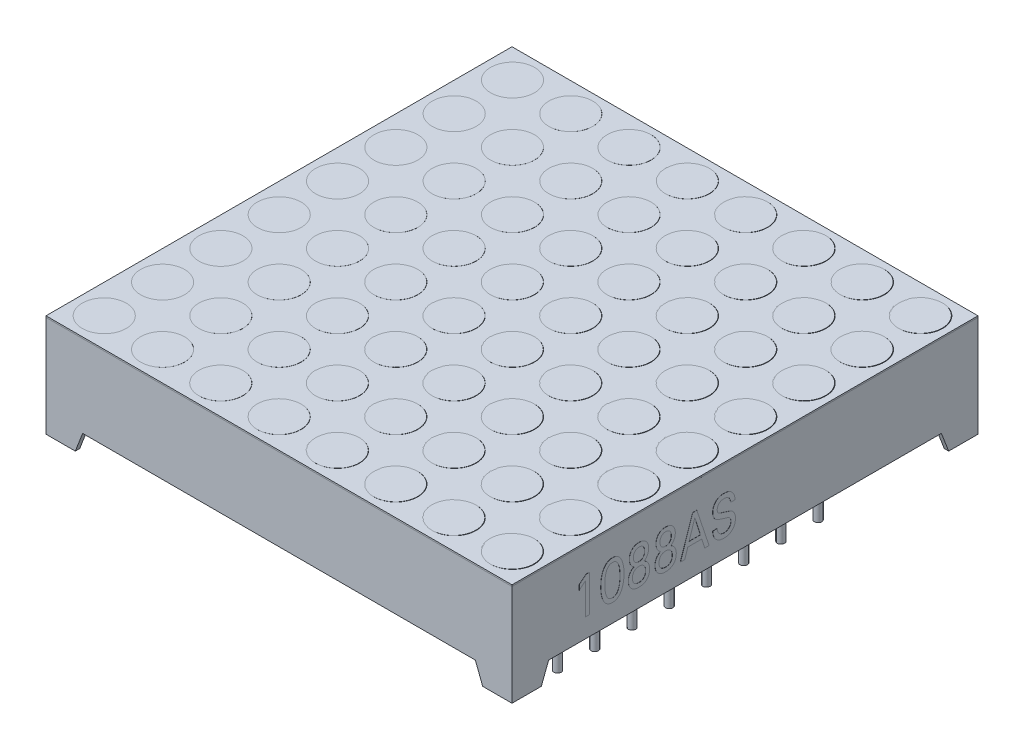
from build123d import *

# Parameters (mm, degrees)
SKETCH1_W               = 31.8
SKETCH1_H               = 31.8
SKETCH1_R               = 1.5
TOP_MASK_DEPTH          = 0.1
SKETCH2_W               = 31.8
SKETCH2_H               = 31.8
SKETCH2_W_2             = 31.2
SKETCH2_H_2             = 31.2
SIDES_DEPTH             = 6.9
CUT_EXTRUDE2_DEPTH      = 46.513514476
CUT_EXTRUDE2_DEPTH_BACK = 46.513514476
CUT_EXTRUDE3_DEPTH      = 46.513514476
SKETCH5_R               = 1.5
BOSS_EXTRUDE3_DEPTH     = 0.1
BOSS_EXTRUDE3_2_DEPTH   = 0.1
BOSS_EXTRUDE3_3_DEPTH   = 0.1
BOSS_EXTRUDE3_4_DEPTH   = 0.1
BOSS_EXTRUDE3_5_DEPTH   = 0.1
BOSS_EXTRUDE3_6_DEPTH   = 0.1
BOSS_EXTRUDE3_7_DEPTH   = 0.1
BOSS_EXTRUDE3_8_DEPTH   = 0.1
BOSS_EXTRUDE3_9_DEPTH   = 0.1
BOSS_EXTRUDE3_10_DEPTH  = 0.1
BOSS_EXTRUDE3_11_DEPTH  = 0.1
BOSS_EXTRUDE3_12_DEPTH  = 0.1
BOSS_EXTRUDE3_13_DEPTH  = 0.1
BOSS_EXTRUDE3_14_DEPTH  = 0.1
BOSS_EXTRUDE3_15_DEPTH  = 0.1
BOSS_EXTRUDE3_16_DEPTH  = 0.1
BOSS_EXTRUDE3_17_DEPTH  = 0.1
BOSS_EXTRUDE3_18_DEPTH  = 0.1
BOSS_EXTRUDE3_19_DEPTH  = 0.1
BOSS_EXTRUDE3_20_DEPTH  = 0.1
BOSS_EXTRUDE3_21_DEPTH  = 0.1
BOSS_EXTRUDE3_22_DEPTH  = 0.1
BOSS_EXTRUDE3_23_DEPTH  = 0.1
BOSS_EXTRUDE3_24_DEPTH  = 0.1
BOSS_EXTRUDE3_25_DEPTH  = 0.1
BOSS_EXTRUDE3_26_DEPTH  = 0.1
BOSS_EXTRUDE3_27_DEPTH  = 0.1
BOSS_EXTRUDE3_28_DEPTH  = 0.1
BOSS_EXTRUDE3_29_DEPTH  = 0.1
BOSS_EXTRUDE3_30_DEPTH  = 0.1
BOSS_EXTRUDE3_31_DEPTH  = 0.1
BOSS_EXTRUDE3_32_DEPTH  = 0.1
BOSS_EXTRUDE3_33_DEPTH  = 0.1
BOSS_EXTRUDE3_34_DEPTH  = 0.1
BOSS_EXTRUDE3_35_DEPTH  = 0.1
BOSS_EXTRUDE3_36_DEPTH  = 0.1
BOSS_EXTRUDE3_37_DEPTH  = 0.1
BOSS_EXTRUDE3_38_DEPTH  = 0.1
BOSS_EXTRUDE3_39_DEPTH  = 0.1
BOSS_EXTRUDE3_40_DEPTH  = 0.1
BOSS_EXTRUDE3_41_DEPTH  = 0.1
BOSS_EXTRUDE3_42_DEPTH  = 0.1
BOSS_EXTRUDE3_43_DEPTH  = 0.1
BOSS_EXTRUDE3_44_DEPTH  = 0.1
BOSS_EXTRUDE3_45_DEPTH  = 0.1
BOSS_EXTRUDE3_46_DEPTH  = 0.1
BOSS_EXTRUDE3_47_DEPTH  = 0.1
BOSS_EXTRUDE3_48_DEPTH  = 0.1
BOSS_EXTRUDE3_49_DEPTH  = 0.1
BOSS_EXTRUDE3_50_DEPTH  = 0.1
BOSS_EXTRUDE3_51_DEPTH  = 0.1
BOSS_EXTRUDE3_52_DEPTH  = 0.1
BOSS_EXTRUDE3_53_DEPTH  = 0.1
BOSS_EXTRUDE3_54_DEPTH  = 0.1
BOSS_EXTRUDE3_55_DEPTH  = 0.1
BOSS_EXTRUDE3_56_DEPTH  = 0.1
BOSS_EXTRUDE3_57_DEPTH  = 0.1
BOSS_EXTRUDE3_58_DEPTH  = 0.1
BOSS_EXTRUDE3_59_DEPTH  = 0.1
BOSS_EXTRUDE3_60_DEPTH  = 0.1
BOSS_EXTRUDE3_61_DEPTH  = 0.1
BOSS_EXTRUDE3_62_DEPTH  = 0.1
BOSS_EXTRUDE3_63_DEPTH  = 0.1
BOSS_EXTRUDE3_64_DEPTH  = 0.1
BOSS_EXTRUDE4_START     = -1.5
SKETCH6_W               = 31.2
SKETCH6_H               = 31.2
BOSS_EXTRUDE4_DEPTH     = 4.1
SKETCH7_R               = 0.25
BOSS_EXTRUDE5_DEPTH     = 6.3
BOSS_EXTRUDE5_2_DEPTH   = 6.3
BOSS_EXTRUDE5_3_DEPTH   = 6.3
BOSS_EXTRUDE5_4_DEPTH   = 6.3
BOSS_EXTRUDE5_5_DEPTH   = 6.3
BOSS_EXTRUDE5_6_DEPTH   = 6.3
BOSS_EXTRUDE5_7_DEPTH   = 6.3
BOSS_EXTRUDE5_8_DEPTH   = 6.3
BOSS_EXTRUDE5_9_DEPTH   = 6.3
BOSS_EXTRUDE5_10_DEPTH  = 6.3
BOSS_EXTRUDE5_11_DEPTH  = 6.3
BOSS_EXTRUDE5_12_DEPTH  = 6.3
BOSS_EXTRUDE5_13_DEPTH  = 6.3
BOSS_EXTRUDE5_14_DEPTH  = 6.3
BOSS_EXTRUDE5_15_DEPTH  = 6.3
BOSS_EXTRUDE5_16_DEPTH  = 6.3
F_1088AS_DEPTH          = 0.01
F_1088AS_2_DEPTH        = 0.01
F_1088AS_3_DEPTH        = 0.01
F_1088AS_4_DEPTH        = 0.01
F_1088AS_5_DEPTH        = 0.01
F_1088AS_6_DEPTH        = 0.01


with BuildPart() as part:
    # Sketch1 → TOP MASK (new body)
    with BuildSketch(Plane(origin=(0, 0, 0), x_dir=(1, 0, 0), z_dir=(0, 1, 0))):
        with Locations((15.9, 15.9)):
            Rectangle(SKETCH1_W, SKETCH1_H)
        with Locations(Location((1.9875, 1.9875, 0), (0, 0, 270))):
            Circle(SKETCH1_R, mode=Mode.SUBTRACT)
        with Locations(Location((5.9675, 1.9875, 0), (0, 0, 270))):
            Circle(SKETCH1_R, mode=Mode.SUBTRACT)
        with Locations(Location((9.9475, 1.9875, 0), (0, 0, 270))):
            Circle(SKETCH1_R, mode=Mode.SUBTRACT)
        with Locations(Location((13.9275, 1.9875, 0), (0, 0, 270))):
            Circle(SKETCH1_R, mode=Mode.SUBTRACT)
        with Locations(Location((17.9075, 1.9875, 0), (0, 0, 270))):
            Circle(SKETCH1_R, mode=Mode.SUBTRACT)
        with Locations(Location((21.8875, 1.9875, 0), (0, 0, 270))):
            Circle(SKETCH1_R, mode=Mode.SUBTRACT)
        with Locations(Location((25.8675, 1.9875, 0), (0, 0, 270))):
            Circle(SKETCH1_R, mode=Mode.SUBTRACT)
        with Locations(Location((29.8475, 1.9875, 0), (0, 0, 270))):
            Circle(SKETCH1_R, mode=Mode.SUBTRACT)
        with Locations(Location((5.9675, 5.9675, 0), (0, 0, 270))):
            Circle(SKETCH1_R, mode=Mode.SUBTRACT)
        with Locations(Location((9.9475, 5.9675, 0), (0, 0, 270))):
            Circle(SKETCH1_R, mode=Mode.SUBTRACT)
        with Locations(Location((13.9275, 5.9675, 0), (0, 0, 270))):
            Circle(SKETCH1_R, mode=Mode.SUBTRACT)
        with Locations(Location((17.9075, 5.9675, 0), (0, 0, 270))):
            Circle(SKETCH1_R, mode=Mode.SUBTRACT)
        with Locations(Location((21.8875, 5.9675, 0), (0, 0, 270))):
            Circle(SKETCH1_R, mode=Mode.SUBTRACT)
        with Locations(Location((25.8675, 5.9675, 0), (0, 0, 270))):
            Circle(SKETCH1_R, mode=Mode.SUBTRACT)
        with Locations(Location((29.8475, 5.9675, 0), (0, 0, 270))):
            Circle(SKETCH1_R, mode=Mode.SUBTRACT)
        with Locations(Location((5.9675, 9.9475, 0), (0, 0, 270))):
            Circle(SKETCH1_R, mode=Mode.SUBTRACT)
        with Locations(Location((9.9475, 9.9475, 0), (0, 0, 270))):
            Circle(SKETCH1_R, mode=Mode.SUBTRACT)
        with Locations(Location((13.9275, 9.9475, 0), (0, 0, 270))):
            Circle(SKETCH1_R, mode=Mode.SUBTRACT)
        with Locations(Location((17.9075, 9.9475, 0), (0, 0, 270))):
            Circle(SKETCH1_R, mode=Mode.SUBTRACT)
        with Locations(Location((21.8875, 9.9475, 0), (0, 0, 270))):
            Circle(SKETCH1_R, mode=Mode.SUBTRACT)
        with Locations(Location((25.8675, 9.9475, 0), (0, 0, 270))):
            Circle(SKETCH1_R, mode=Mode.SUBTRACT)
        with Locations(Location((29.8475, 9.9475, 0), (0, 0, 270))):
            Circle(SKETCH1_R, mode=Mode.SUBTRACT)
        with Locations(Location((5.9675, 13.9275, 0), (0, 0, 270))):
            Circle(SKETCH1_R, mode=Mode.SUBTRACT)
        with Locations(Location((9.9475, 13.9275, 0), (0, 0, 270))):
            Circle(SKETCH1_R, mode=Mode.SUBTRACT)
        with Locations(Location((13.9275, 13.9275, 0), (0, 0, 270))):
            Circle(SKETCH1_R, mode=Mode.SUBTRACT)
        with Locations(Location((17.9075, 13.9275, 0), (0, 0, 270))):
            Circle(SKETCH1_R, mode=Mode.SUBTRACT)
        with Locations(Location((21.8875, 13.9275, 0), (0, 0, 270))):
            Circle(SKETCH1_R, mode=Mode.SUBTRACT)
        with Locations(Location((25.8675, 13.9275, 0), (0, 0, 270))):
            Circle(SKETCH1_R, mode=Mode.SUBTRACT)
        with Locations(Location((29.8475, 13.9275, 0), (0, 0, 270))):
            Circle(SKETCH1_R, mode=Mode.SUBTRACT)
        with Locations(Location((5.9675, 17.9075, 0), (0, 0, 270))):
            Circle(SKETCH1_R, mode=Mode.SUBTRACT)
        with Locations(Location((9.9475, 17.9075, 0), (0, 0, 270))):
            Circle(SKETCH1_R, mode=Mode.SUBTRACT)
        with Locations(Location((13.9275, 17.9075, 0), (0, 0, 270))):
            Circle(SKETCH1_R, mode=Mode.SUBTRACT)
        with Locations(Location((17.9075, 17.9075, 0), (0, 0, 270))):
            Circle(SKETCH1_R, mode=Mode.SUBTRACT)
        with Locations(Location((21.8875, 17.9075, 0), (0, 0, 270))):
            Circle(SKETCH1_R, mode=Mode.SUBTRACT)
        with Locations(Location((25.8675, 17.9075, 0), (0, 0, 270))):
            Circle(SKETCH1_R, mode=Mode.SUBTRACT)
        with Locations(Location((29.8475, 17.9075, 0), (0, 0, 270))):
            Circle(SKETCH1_R, mode=Mode.SUBTRACT)
        with Locations(Location((5.9675, 21.8875, 0), (0, 0, 270))):
            Circle(SKETCH1_R, mode=Mode.SUBTRACT)
        with Locations(Location((9.9475, 21.8875, 0), (0, 0, 270))):
            Circle(SKETCH1_R, mode=Mode.SUBTRACT)
        with Locations(Location((13.9275, 21.8875, 0), (0, 0, 270))):
            Circle(SKETCH1_R, mode=Mode.SUBTRACT)
        with Locations(Location((17.9075, 21.8875, 0), (0, 0, 270))):
            Circle(SKETCH1_R, mode=Mode.SUBTRACT)
        with Locations(Location((21.8875, 21.8875, 0), (0, 0, 270))):
            Circle(SKETCH1_R, mode=Mode.SUBTRACT)
        with Locations(Location((25.8675, 21.8875, 0), (0, 0, 270))):
            Circle(SKETCH1_R, mode=Mode.SUBTRACT)
        with Locations(Location((29.8475, 21.8875, 0), (0, 0, 270))):
            Circle(SKETCH1_R, mode=Mode.SUBTRACT)
        with Locations(Location((5.9675, 25.8675, 0), (0, 0, 270))):
            Circle(SKETCH1_R, mode=Mode.SUBTRACT)
        with Locations(Location((9.9475, 25.8675, 0), (0, 0, 270))):
            Circle(SKETCH1_R, mode=Mode.SUBTRACT)
        with Locations(Location((13.9275, 25.8675, 0), (0, 0, 270))):
            Circle(SKETCH1_R, mode=Mode.SUBTRACT)
        with Locations(Location((17.9075, 25.8675, 0), (0, 0, 270))):
            Circle(SKETCH1_R, mode=Mode.SUBTRACT)
        with Locations(Location((21.8875, 25.8675, 0), (0, 0, 270))):
            Circle(SKETCH1_R, mode=Mode.SUBTRACT)
        with Locations(Location((25.8675, 25.8675, 0), (0, 0, 270))):
            Circle(SKETCH1_R, mode=Mode.SUBTRACT)
        with Locations(Location((29.8475, 25.8675, 0), (0, 0, 270))):
            Circle(SKETCH1_R, mode=Mode.SUBTRACT)
        with Locations(Location((5.9675, 29.8475, 0), (0, 0, 270))):
            Circle(SKETCH1_R, mode=Mode.SUBTRACT)
        with Locations(Location((9.9475, 29.8475, 0), (0, 0, 270))):
            Circle(SKETCH1_R, mode=Mode.SUBTRACT)
        with Locations(Location((13.9275, 29.8475, 0), (0, 0, 270))):
            Circle(SKETCH1_R, mode=Mode.SUBTRACT)
        with Locations(Location((17.9075, 29.8475, 0), (0, 0, 270))):
            Circle(SKETCH1_R, mode=Mode.SUBTRACT)
        with Locations(Location((21.8875, 29.8475, 0), (0, 0, 270))):
            Circle(SKETCH1_R, mode=Mode.SUBTRACT)
        with Locations(Location((25.8675, 29.8475, 0), (0, 0, 270))):
            Circle(SKETCH1_R, mode=Mode.SUBTRACT)
        with Locations(Location((29.8475, 29.8475, 0), (0, 0, 270))):
            Circle(SKETCH1_R, mode=Mode.SUBTRACT)
        with Locations(Location((1.9875, 5.9675, 0), (0, 0, 270))):
            Circle(SKETCH1_R, mode=Mode.SUBTRACT)
        with Locations(Location((1.9875, 9.9475, 0), (0, 0, 270))):
            Circle(SKETCH1_R, mode=Mode.SUBTRACT)
        with Locations(Location((1.9875, 13.9275, 0), (0, 0, 270))):
            Circle(SKETCH1_R, mode=Mode.SUBTRACT)
        with Locations(Location((1.9875, 17.9075, 0), (0, 0, 270))):
            Circle(SKETCH1_R, mode=Mode.SUBTRACT)
        with Locations(Location((1.9875, 21.8875, 0), (0, 0, 270))):
            Circle(SKETCH1_R, mode=Mode.SUBTRACT)
        with Locations(Location((1.9875, 25.8675, 0), (0, 0, 270))):
            Circle(SKETCH1_R, mode=Mode.SUBTRACT)
        with Locations(Location((1.9875, 29.8475, 0), (0, 0, 270))):
            Circle(SKETCH1_R, mode=Mode.SUBTRACT)
    extrude(amount=-TOP_MASK_DEPTH)


with BuildPart() as body_2:
    # Sketch2 → SIDES (new body)
    with BuildSketch(Plane.XZ.offset(0.1)):
        with Locations((15.9, -15.9)):
            Rectangle(SKETCH2_W, SKETCH2_H)
        with Locations((15.9, -15.9)):
            Rectangle(SKETCH2_W_2, SKETCH2_H_2, mode=Mode.SUBTRACT)
    extrude(amount=SIDES_DEPTH)

    # Sketch3 → Cut-Extrude2 (cut, two sides: drawn at the far end of the back side and taken through both)
    with BuildSketch(Plane(origin=(0, 0, -31.8), x_dir=(-1, 0, 0), z_dir=(0, 0, -1)).offset(-CUT_EXTRUDE2_DEPTH_BACK)):
        Polygon((-29.8, -7), (-2, -7), (-2.5, -5.7), (-29.3, -5.7), align=None)
    extrude(amount=CUT_EXTRUDE2_DEPTH + CUT_EXTRUDE2_DEPTH_BACK, mode=Mode.SUBTRACT)

    # Sketch4 → Cut-Extrude3 (cut, through all)
    with BuildSketch(Plane.ZY):
        Polygon((-29.8, -7), (-29.3, -5.7), (-2.5, -5.7), (-2, -7), align=None)
    extrude(amount=-CUT_EXTRUDE3_DEPTH, mode=Mode.SUBTRACT)


with BuildPart() as body_3:
    # Sketch5 → Boss-Extrude3 (new body)
    with BuildSketch(Plane(origin=(0, 0, 0), x_dir=(1, 0, 0), z_dir=(0, 1, 0))):
        with Locations(Location((1.9875, 1.9875, 0), (0, 0, 270))):
            Circle(SKETCH5_R)
    extrude(amount=-BOSS_EXTRUDE3_DEPTH)


with BuildPart() as body_4:
    # Sketch5 → Boss-Extrude3 2 (new body)
    with BuildSketch(Plane(origin=(0, 0, 0), x_dir=(1, 0, 0), z_dir=(0, 1, 0))):
        with Locations(Location((5.9625, 1.9875, 0), (0, 0, 270))):
            Circle(SKETCH5_R)
    extrude(amount=-BOSS_EXTRUDE3_2_DEPTH)


with BuildPart() as body_5:
    # Sketch5 → Boss-Extrude3 3 (new body)
    with BuildSketch(Plane(origin=(0, 0, 0), x_dir=(1, 0, 0), z_dir=(0, 1, 0))):
        with Locations(Location((9.9375, 1.9875, 0), (0, 0, 270))):
            Circle(SKETCH5_R)
    extrude(amount=-BOSS_EXTRUDE3_3_DEPTH)


with BuildPart() as body_6:
    # Sketch5 → Boss-Extrude3 4 (new body)
    with BuildSketch(Plane(origin=(0, 0, 0), x_dir=(1, 0, 0), z_dir=(0, 1, 0))):
        with Locations(Location((13.9125, 1.9875, 0), (0, 0, 270))):
            Circle(SKETCH5_R)
    extrude(amount=-BOSS_EXTRUDE3_4_DEPTH)


with BuildPart() as body_7:
    # Sketch5 → Boss-Extrude3 5 (new body)
    with BuildSketch(Plane(origin=(0, 0, 0), x_dir=(1, 0, 0), z_dir=(0, 1, 0))):
        with Locations(Location((17.8875, 1.9875, 0), (0, 0, 270))):
            Circle(SKETCH5_R)
    extrude(amount=-BOSS_EXTRUDE3_5_DEPTH)


with BuildPart() as body_8:
    # Sketch5 → Boss-Extrude3 6 (new body)
    with BuildSketch(Plane(origin=(0, 0, 0), x_dir=(1, 0, 0), z_dir=(0, 1, 0))):
        with Locations(Location((21.8625, 1.9875, 0), (0, 0, 270))):
            Circle(SKETCH5_R)
    extrude(amount=-BOSS_EXTRUDE3_6_DEPTH)


with BuildPart() as body_9:
    # Sketch5 → Boss-Extrude3 7 (new body)
    with BuildSketch(Plane(origin=(0, 0, 0), x_dir=(1, 0, 0), z_dir=(0, 1, 0))):
        with Locations(Location((25.8375, 1.9875, 0), (0, 0, 270))):
            Circle(SKETCH5_R)
    extrude(amount=-BOSS_EXTRUDE3_7_DEPTH)


with BuildPart() as body_10:
    # Sketch5 → Boss-Extrude3 8 (new body)
    with BuildSketch(Plane(origin=(0, 0, 0), x_dir=(1, 0, 0), z_dir=(0, 1, 0))):
        with Locations(Location((29.8125, 1.9875, 0), (0, 0, 270))):
            Circle(SKETCH5_R)
    extrude(amount=-BOSS_EXTRUDE3_8_DEPTH)


with BuildPart() as body_11:
    # Sketch5 → Boss-Extrude3 9 (new body)
    with BuildSketch(Plane(origin=(0, 0, 0), x_dir=(1, 0, 0), z_dir=(0, 1, 0))):
        with Locations(Location((5.9625, 5.9675, 0), (0, 0, 270))):
            Circle(SKETCH5_R)
    extrude(amount=-BOSS_EXTRUDE3_9_DEPTH)


with BuildPart() as body_12:
    # Sketch5 → Boss-Extrude3 10 (new body)
    with BuildSketch(Plane(origin=(0, 0, 0), x_dir=(1, 0, 0), z_dir=(0, 1, 0))):
        with Locations(Location((9.9375, 5.9675, 0), (0, 0, 270))):
            Circle(SKETCH5_R)
    extrude(amount=-BOSS_EXTRUDE3_10_DEPTH)


with BuildPart() as body_13:
    # Sketch5 → Boss-Extrude3 11 (new body)
    with BuildSketch(Plane(origin=(0, 0, 0), x_dir=(1, 0, 0), z_dir=(0, 1, 0))):
        with Locations(Location((13.9125, 5.9675, 0), (0, 0, 270))):
            Circle(SKETCH5_R)
    extrude(amount=-BOSS_EXTRUDE3_11_DEPTH)


with BuildPart() as body_14:
    # Sketch5 → Boss-Extrude3 12 (new body)
    with BuildSketch(Plane(origin=(0, 0, 0), x_dir=(1, 0, 0), z_dir=(0, 1, 0))):
        with Locations(Location((17.8875, 5.9675, 0), (0, 0, 270))):
            Circle(SKETCH5_R)
    extrude(amount=-BOSS_EXTRUDE3_12_DEPTH)


with BuildPart() as body_15:
    # Sketch5 → Boss-Extrude3 13 (new body)
    with BuildSketch(Plane(origin=(0, 0, 0), x_dir=(1, 0, 0), z_dir=(0, 1, 0))):
        with Locations(Location((21.8625, 5.9675, 0), (0, 0, 270))):
            Circle(SKETCH5_R)
    extrude(amount=-BOSS_EXTRUDE3_13_DEPTH)


with BuildPart() as body_16:
    # Sketch5 → Boss-Extrude3 14 (new body)
    with BuildSketch(Plane(origin=(0, 0, 0), x_dir=(1, 0, 0), z_dir=(0, 1, 0))):
        with Locations(Location((25.8375, 5.9675, 0), (0, 0, 270))):
            Circle(SKETCH5_R)
    extrude(amount=-BOSS_EXTRUDE3_14_DEPTH)


with BuildPart() as body_17:
    # Sketch5 → Boss-Extrude3 15 (new body)
    with BuildSketch(Plane(origin=(0, 0, 0), x_dir=(1, 0, 0), z_dir=(0, 1, 0))):
        with Locations(Location((29.8125, 5.9675, 0), (0, 0, 270))):
            Circle(SKETCH5_R)
    extrude(amount=-BOSS_EXTRUDE3_15_DEPTH)


with BuildPart() as body_18:
    # Sketch5 → Boss-Extrude3 16 (new body)
    with BuildSketch(Plane(origin=(0, 0, 0), x_dir=(1, 0, 0), z_dir=(0, 1, 0))):
        with Locations(Location((5.9625, 9.9475, 0), (0, 0, 270))):
            Circle(SKETCH5_R)
    extrude(amount=-BOSS_EXTRUDE3_16_DEPTH)


with BuildPart() as body_19:
    # Sketch5 → Boss-Extrude3 17 (new body)
    with BuildSketch(Plane(origin=(0, 0, 0), x_dir=(1, 0, 0), z_dir=(0, 1, 0))):
        with Locations(Location((9.9375, 9.9475, 0), (0, 0, 270))):
            Circle(SKETCH5_R)
    extrude(amount=-BOSS_EXTRUDE3_17_DEPTH)


with BuildPart() as body_20:
    # Sketch5 → Boss-Extrude3 18 (new body)
    with BuildSketch(Plane(origin=(0, 0, 0), x_dir=(1, 0, 0), z_dir=(0, 1, 0))):
        with Locations(Location((13.9125, 9.9475, 0), (0, 0, 270))):
            Circle(SKETCH5_R)
    extrude(amount=-BOSS_EXTRUDE3_18_DEPTH)


with BuildPart() as body_21:
    # Sketch5 → Boss-Extrude3 19 (new body)
    with BuildSketch(Plane(origin=(0, 0, 0), x_dir=(1, 0, 0), z_dir=(0, 1, 0))):
        with Locations(Location((17.8875, 9.9475, 0), (0, 0, 270))):
            Circle(SKETCH5_R)
    extrude(amount=-BOSS_EXTRUDE3_19_DEPTH)


with BuildPart() as body_22:
    # Sketch5 → Boss-Extrude3 20 (new body)
    with BuildSketch(Plane(origin=(0, 0, 0), x_dir=(1, 0, 0), z_dir=(0, 1, 0))):
        with Locations(Location((21.8625, 9.9475, 0), (0, 0, 270))):
            Circle(SKETCH5_R)
    extrude(amount=-BOSS_EXTRUDE3_20_DEPTH)


with BuildPart() as body_23:
    # Sketch5 → Boss-Extrude3 21 (new body)
    with BuildSketch(Plane(origin=(0, 0, 0), x_dir=(1, 0, 0), z_dir=(0, 1, 0))):
        with Locations(Location((25.8375, 9.9475, 0), (0, 0, 270))):
            Circle(SKETCH5_R)
    extrude(amount=-BOSS_EXTRUDE3_21_DEPTH)


with BuildPart() as body_24:
    # Sketch5 → Boss-Extrude3 22 (new body)
    with BuildSketch(Plane(origin=(0, 0, 0), x_dir=(1, 0, 0), z_dir=(0, 1, 0))):
        with Locations(Location((29.8125, 9.9475, 0), (0, 0, 270))):
            Circle(SKETCH5_R)
    extrude(amount=-BOSS_EXTRUDE3_22_DEPTH)


with BuildPart() as body_25:
    # Sketch5 → Boss-Extrude3 23 (new body)
    with BuildSketch(Plane(origin=(0, 0, 0), x_dir=(1, 0, 0), z_dir=(0, 1, 0))):
        with Locations(Location((5.9625, 13.9275, 0), (0, 0, 270))):
            Circle(SKETCH5_R)
    extrude(amount=-BOSS_EXTRUDE3_23_DEPTH)


with BuildPart() as body_26:
    # Sketch5 → Boss-Extrude3 24 (new body)
    with BuildSketch(Plane(origin=(0, 0, 0), x_dir=(1, 0, 0), z_dir=(0, 1, 0))):
        with Locations(Location((9.9375, 13.9275, 0), (0, 0, 270))):
            Circle(SKETCH5_R)
    extrude(amount=-BOSS_EXTRUDE3_24_DEPTH)


with BuildPart() as body_27:
    # Sketch5 → Boss-Extrude3 25 (new body)
    with BuildSketch(Plane(origin=(0, 0, 0), x_dir=(1, 0, 0), z_dir=(0, 1, 0))):
        with Locations(Location((13.9125, 13.9275, 0), (0, 0, 270))):
            Circle(SKETCH5_R)
    extrude(amount=-BOSS_EXTRUDE3_25_DEPTH)


with BuildPart() as body_28:
    # Sketch5 → Boss-Extrude3 26 (new body)
    with BuildSketch(Plane(origin=(0, 0, 0), x_dir=(1, 0, 0), z_dir=(0, 1, 0))):
        with Locations(Location((17.8875, 13.9275, 0), (0, 0, 270))):
            Circle(SKETCH5_R)
    extrude(amount=-BOSS_EXTRUDE3_26_DEPTH)


with BuildPart() as body_29:
    # Sketch5 → Boss-Extrude3 27 (new body)
    with BuildSketch(Plane(origin=(0, 0, 0), x_dir=(1, 0, 0), z_dir=(0, 1, 0))):
        with Locations(Location((21.8625, 13.9275, 0), (0, 0, 270))):
            Circle(SKETCH5_R)
    extrude(amount=-BOSS_EXTRUDE3_27_DEPTH)


with BuildPart() as body_30:
    # Sketch5 → Boss-Extrude3 28 (new body)
    with BuildSketch(Plane(origin=(0, 0, 0), x_dir=(1, 0, 0), z_dir=(0, 1, 0))):
        with Locations(Location((25.8375, 13.9275, 0), (0, 0, 270))):
            Circle(SKETCH5_R)
    extrude(amount=-BOSS_EXTRUDE3_28_DEPTH)


with BuildPart() as body_31:
    # Sketch5 → Boss-Extrude3 29 (new body)
    with BuildSketch(Plane(origin=(0, 0, 0), x_dir=(1, 0, 0), z_dir=(0, 1, 0))):
        with Locations(Location((29.8125, 13.9275, 0), (0, 0, 270))):
            Circle(SKETCH5_R)
    extrude(amount=-BOSS_EXTRUDE3_29_DEPTH)


with BuildPart() as body_32:
    # Sketch5 → Boss-Extrude3 30 (new body)
    with BuildSketch(Plane(origin=(0, 0, 0), x_dir=(1, 0, 0), z_dir=(0, 1, 0))):
        with Locations(Location((5.9625, 17.9075, 0), (0, 0, 270))):
            Circle(SKETCH5_R)
    extrude(amount=-BOSS_EXTRUDE3_30_DEPTH)


with BuildPart() as body_33:
    # Sketch5 → Boss-Extrude3 31 (new body)
    with BuildSketch(Plane(origin=(0, 0, 0), x_dir=(1, 0, 0), z_dir=(0, 1, 0))):
        with Locations(Location((9.9375, 17.9075, 0), (0, 0, 270))):
            Circle(SKETCH5_R)
    extrude(amount=-BOSS_EXTRUDE3_31_DEPTH)


with BuildPart() as body_34:
    # Sketch5 → Boss-Extrude3 32 (new body)
    with BuildSketch(Plane(origin=(0, 0, 0), x_dir=(1, 0, 0), z_dir=(0, 1, 0))):
        with Locations(Location((13.9125, 17.9075, 0), (0, 0, 270))):
            Circle(SKETCH5_R)
    extrude(amount=-BOSS_EXTRUDE3_32_DEPTH)


with BuildPart() as body_35:
    # Sketch5 → Boss-Extrude3 33 (new body)
    with BuildSketch(Plane(origin=(0, 0, 0), x_dir=(1, 0, 0), z_dir=(0, 1, 0))):
        with Locations(Location((17.8875, 17.9075, 0), (0, 0, 270))):
            Circle(SKETCH5_R)
    extrude(amount=-BOSS_EXTRUDE3_33_DEPTH)


with BuildPart() as body_36:
    # Sketch5 → Boss-Extrude3 34 (new body)
    with BuildSketch(Plane(origin=(0, 0, 0), x_dir=(1, 0, 0), z_dir=(0, 1, 0))):
        with Locations(Location((21.8625, 17.9075, 0), (0, 0, 270))):
            Circle(SKETCH5_R)
    extrude(amount=-BOSS_EXTRUDE3_34_DEPTH)


with BuildPart() as body_37:
    # Sketch5 → Boss-Extrude3 35 (new body)
    with BuildSketch(Plane(origin=(0, 0, 0), x_dir=(1, 0, 0), z_dir=(0, 1, 0))):
        with Locations(Location((25.8375, 17.9075, 0), (0, 0, 270))):
            Circle(SKETCH5_R)
    extrude(amount=-BOSS_EXTRUDE3_35_DEPTH)


with BuildPart() as body_38:
    # Sketch5 → Boss-Extrude3 36 (new body)
    with BuildSketch(Plane(origin=(0, 0, 0), x_dir=(1, 0, 0), z_dir=(0, 1, 0))):
        with Locations(Location((29.8125, 17.9075, 0), (0, 0, 270))):
            Circle(SKETCH5_R)
    extrude(amount=-BOSS_EXTRUDE3_36_DEPTH)


with BuildPart() as body_39:
    # Sketch5 → Boss-Extrude3 37 (new body)
    with BuildSketch(Plane(origin=(0, 0, 0), x_dir=(1, 0, 0), z_dir=(0, 1, 0))):
        with Locations(Location((5.9625, 21.8875, 0), (0, 0, 270))):
            Circle(SKETCH5_R)
    extrude(amount=-BOSS_EXTRUDE3_37_DEPTH)


with BuildPart() as body_40:
    # Sketch5 → Boss-Extrude3 38 (new body)
    with BuildSketch(Plane(origin=(0, 0, 0), x_dir=(1, 0, 0), z_dir=(0, 1, 0))):
        with Locations(Location((9.9375, 21.8875, 0), (0, 0, 270))):
            Circle(SKETCH5_R)
    extrude(amount=-BOSS_EXTRUDE3_38_DEPTH)


with BuildPart() as body_41:
    # Sketch5 → Boss-Extrude3 39 (new body)
    with BuildSketch(Plane(origin=(0, 0, 0), x_dir=(1, 0, 0), z_dir=(0, 1, 0))):
        with Locations(Location((13.9125, 21.8875, 0), (0, 0, 270))):
            Circle(SKETCH5_R)
    extrude(amount=-BOSS_EXTRUDE3_39_DEPTH)


with BuildPart() as body_42:
    # Sketch5 → Boss-Extrude3 40 (new body)
    with BuildSketch(Plane(origin=(0, 0, 0), x_dir=(1, 0, 0), z_dir=(0, 1, 0))):
        with Locations(Location((17.8875, 21.8875, 0), (0, 0, 270))):
            Circle(SKETCH5_R)
    extrude(amount=-BOSS_EXTRUDE3_40_DEPTH)


with BuildPart() as body_43:
    # Sketch5 → Boss-Extrude3 41 (new body)
    with BuildSketch(Plane(origin=(0, 0, 0), x_dir=(1, 0, 0), z_dir=(0, 1, 0))):
        with Locations(Location((21.8625, 21.8875, 0), (0, 0, 270))):
            Circle(SKETCH5_R)
    extrude(amount=-BOSS_EXTRUDE3_41_DEPTH)


with BuildPart() as body_44:
    # Sketch5 → Boss-Extrude3 42 (new body)
    with BuildSketch(Plane(origin=(0, 0, 0), x_dir=(1, 0, 0), z_dir=(0, 1, 0))):
        with Locations(Location((25.8375, 21.8875, 0), (0, 0, 270))):
            Circle(SKETCH5_R)
    extrude(amount=-BOSS_EXTRUDE3_42_DEPTH)


with BuildPart() as body_45:
    # Sketch5 → Boss-Extrude3 43 (new body)
    with BuildSketch(Plane(origin=(0, 0, 0), x_dir=(1, 0, 0), z_dir=(0, 1, 0))):
        with Locations(Location((29.8125, 21.8875, 0), (0, 0, 270))):
            Circle(SKETCH5_R)
    extrude(amount=-BOSS_EXTRUDE3_43_DEPTH)


with BuildPart() as body_46:
    # Sketch5 → Boss-Extrude3 44 (new body)
    with BuildSketch(Plane(origin=(0, 0, 0), x_dir=(1, 0, 0), z_dir=(0, 1, 0))):
        with Locations(Location((5.9625, 25.8675, 0), (0, 0, 270))):
            Circle(SKETCH5_R)
    extrude(amount=-BOSS_EXTRUDE3_44_DEPTH)


with BuildPart() as body_47:
    # Sketch5 → Boss-Extrude3 45 (new body)
    with BuildSketch(Plane(origin=(0, 0, 0), x_dir=(1, 0, 0), z_dir=(0, 1, 0))):
        with Locations(Location((9.9375, 25.8675, 0), (0, 0, 270))):
            Circle(SKETCH5_R)
    extrude(amount=-BOSS_EXTRUDE3_45_DEPTH)


with BuildPart() as body_48:
    # Sketch5 → Boss-Extrude3 46 (new body)
    with BuildSketch(Plane(origin=(0, 0, 0), x_dir=(1, 0, 0), z_dir=(0, 1, 0))):
        with Locations(Location((13.9125, 25.8675, 0), (0, 0, 270))):
            Circle(SKETCH5_R)
    extrude(amount=-BOSS_EXTRUDE3_46_DEPTH)


with BuildPart() as body_49:
    # Sketch5 → Boss-Extrude3 47 (new body)
    with BuildSketch(Plane(origin=(0, 0, 0), x_dir=(1, 0, 0), z_dir=(0, 1, 0))):
        with Locations(Location((17.8875, 25.8675, 0), (0, 0, 270))):
            Circle(SKETCH5_R)
    extrude(amount=-BOSS_EXTRUDE3_47_DEPTH)


with BuildPart() as body_50:
    # Sketch5 → Boss-Extrude3 48 (new body)
    with BuildSketch(Plane(origin=(0, 0, 0), x_dir=(1, 0, 0), z_dir=(0, 1, 0))):
        with Locations(Location((21.8625, 25.8675, 0), (0, 0, 270))):
            Circle(SKETCH5_R)
    extrude(amount=-BOSS_EXTRUDE3_48_DEPTH)


with BuildPart() as body_51:
    # Sketch5 → Boss-Extrude3 49 (new body)
    with BuildSketch(Plane(origin=(0, 0, 0), x_dir=(1, 0, 0), z_dir=(0, 1, 0))):
        with Locations(Location((25.8375, 25.8675, 0), (0, 0, 270))):
            Circle(SKETCH5_R)
    extrude(amount=-BOSS_EXTRUDE3_49_DEPTH)


with BuildPart() as body_52:
    # Sketch5 → Boss-Extrude3 50 (new body)
    with BuildSketch(Plane(origin=(0, 0, 0), x_dir=(1, 0, 0), z_dir=(0, 1, 0))):
        with Locations(Location((29.8125, 25.8675, 0), (0, 0, 270))):
            Circle(SKETCH5_R)
    extrude(amount=-BOSS_EXTRUDE3_50_DEPTH)


with BuildPart() as body_53:
    # Sketch5 → Boss-Extrude3 51 (new body)
    with BuildSketch(Plane(origin=(0, 0, 0), x_dir=(1, 0, 0), z_dir=(0, 1, 0))):
        with Locations(Location((5.9625, 29.8475, 0), (0, 0, 270))):
            Circle(SKETCH5_R)
    extrude(amount=-BOSS_EXTRUDE3_51_DEPTH)


with BuildPart() as body_54:
    # Sketch5 → Boss-Extrude3 52 (new body)
    with BuildSketch(Plane(origin=(0, 0, 0), x_dir=(1, 0, 0), z_dir=(0, 1, 0))):
        with Locations(Location((9.9375, 29.8475, 0), (0, 0, 270))):
            Circle(SKETCH5_R)
    extrude(amount=-BOSS_EXTRUDE3_52_DEPTH)


with BuildPart() as body_55:
    # Sketch5 → Boss-Extrude3 53 (new body)
    with BuildSketch(Plane(origin=(0, 0, 0), x_dir=(1, 0, 0), z_dir=(0, 1, 0))):
        with Locations(Location((13.9125, 29.8475, 0), (0, 0, 270))):
            Circle(SKETCH5_R)
    extrude(amount=-BOSS_EXTRUDE3_53_DEPTH)


with BuildPart() as body_56:
    # Sketch5 → Boss-Extrude3 54 (new body)
    with BuildSketch(Plane(origin=(0, 0, 0), x_dir=(1, 0, 0), z_dir=(0, 1, 0))):
        with Locations(Location((17.8875, 29.8475, 0), (0, 0, 270))):
            Circle(SKETCH5_R)
    extrude(amount=-BOSS_EXTRUDE3_54_DEPTH)


with BuildPart() as body_57:
    # Sketch5 → Boss-Extrude3 55 (new body)
    with BuildSketch(Plane(origin=(0, 0, 0), x_dir=(1, 0, 0), z_dir=(0, 1, 0))):
        with Locations(Location((21.8625, 29.8475, 0), (0, 0, 270))):
            Circle(SKETCH5_R)
    extrude(amount=-BOSS_EXTRUDE3_55_DEPTH)


with BuildPart() as body_58:
    # Sketch5 → Boss-Extrude3 56 (new body)
    with BuildSketch(Plane(origin=(0, 0, 0), x_dir=(1, 0, 0), z_dir=(0, 1, 0))):
        with Locations(Location((25.8375, 29.8475, 0), (0, 0, 270))):
            Circle(SKETCH5_R)
    extrude(amount=-BOSS_EXTRUDE3_56_DEPTH)


with BuildPart() as body_59:
    # Sketch5 → Boss-Extrude3 57 (new body)
    with BuildSketch(Plane(origin=(0, 0, 0), x_dir=(1, 0, 0), z_dir=(0, 1, 0))):
        with Locations(Location((29.8125, 29.8475, 0), (0, 0, 270))):
            Circle(SKETCH5_R)
    extrude(amount=-BOSS_EXTRUDE3_57_DEPTH)


with BuildPart() as body_60:
    # Sketch5 → Boss-Extrude3 58 (new body)
    with BuildSketch(Plane(origin=(0, 0, 0), x_dir=(1, 0, 0), z_dir=(0, 1, 0))):
        with Locations(Location((1.9875, 5.9675, 0), (0, 0, 270))):
            Circle(SKETCH5_R)
    extrude(amount=-BOSS_EXTRUDE3_58_DEPTH)


with BuildPart() as body_61:
    # Sketch5 → Boss-Extrude3 59 (new body)
    with BuildSketch(Plane(origin=(0, 0, 0), x_dir=(1, 0, 0), z_dir=(0, 1, 0))):
        with Locations(Location((1.9875, 9.9475, 0), (0, 0, 270))):
            Circle(SKETCH5_R)
    extrude(amount=-BOSS_EXTRUDE3_59_DEPTH)


with BuildPart() as body_62:
    # Sketch5 → Boss-Extrude3 60 (new body)
    with BuildSketch(Plane(origin=(0, 0, 0), x_dir=(1, 0, 0), z_dir=(0, 1, 0))):
        with Locations(Location((1.9875, 13.9275, 0), (0, 0, 270))):
            Circle(SKETCH5_R)
    extrude(amount=-BOSS_EXTRUDE3_60_DEPTH)


with BuildPart() as body_63:
    # Sketch5 → Boss-Extrude3 61 (new body)
    with BuildSketch(Plane(origin=(0, 0, 0), x_dir=(1, 0, 0), z_dir=(0, 1, 0))):
        with Locations(Location((1.9875, 17.9075, 0), (0, 0, 270))):
            Circle(SKETCH5_R)
    extrude(amount=-BOSS_EXTRUDE3_61_DEPTH)


with BuildPart() as body_64:
    # Sketch5 → Boss-Extrude3 62 (new body)
    with BuildSketch(Plane(origin=(0, 0, 0), x_dir=(1, 0, 0), z_dir=(0, 1, 0))):
        with Locations(Location((1.9875, 21.8875, 0), (0, 0, 270))):
            Circle(SKETCH5_R)
    extrude(amount=-BOSS_EXTRUDE3_62_DEPTH)


with BuildPart() as body_65:
    # Sketch5 → Boss-Extrude3 63 (new body)
    with BuildSketch(Plane(origin=(0, 0, 0), x_dir=(1, 0, 0), z_dir=(0, 1, 0))):
        with Locations(Location((1.9875, 25.8675, 0), (0, 0, 270))):
            Circle(SKETCH5_R)
    extrude(amount=-BOSS_EXTRUDE3_63_DEPTH)


with BuildPart() as body_66:
    # Sketch5 → Boss-Extrude3 64 (new body)
    with BuildSketch(Plane(origin=(0, 0, 0), x_dir=(1, 0, 0), z_dir=(0, 1, 0))):
        with Locations(Location((1.9875, 29.8475, 0), (0, 0, 270))):
            Circle(SKETCH5_R)
    extrude(amount=-BOSS_EXTRUDE3_64_DEPTH)


with BuildPart() as body_67:
    # Sketch6 → Boss-Extrude4 (new body)
    with BuildSketch(Plane.XZ.offset(5.7).offset(BOSS_EXTRUDE4_START)):
        with Locations((15.9, -15.9)):
            Rectangle(SKETCH6_W, SKETCH6_H)
    extrude(amount=-BOSS_EXTRUDE4_DEPTH)


with BuildPart() as body_68:
    # Sketch7 → Boss-Extrude5 (new body)
    with BuildSketch(Plane.XZ.offset(4.2)):
        with Locations(Location((3.9, -14.63, 0), (0, 0, 270))):
            Circle(SKETCH7_R)
    extrude(amount=BOSS_EXTRUDE5_DEPTH)


with BuildPart() as body_69:
    # Sketch7 → Boss-Extrude5 2 (new body)
    with BuildSketch(Plane.XZ.offset(4.2)):
        with Locations(Location((3.9, -12.09, 0), (0, 0, 270))):
            Circle(SKETCH7_R)
    extrude(amount=BOSS_EXTRUDE5_2_DEPTH)


with BuildPart() as body_70:
    # Sketch7 → Boss-Extrude5 3 (new body)
    with BuildSketch(Plane.XZ.offset(4.2)):
        with Locations(Location((3.9, -9.55, 0), (0, 0, 270))):
            Circle(SKETCH7_R)
    extrude(amount=BOSS_EXTRUDE5_3_DEPTH)


with BuildPart() as body_71:
    # Sketch7 → Boss-Extrude5 4 (new body)
    with BuildSketch(Plane.XZ.offset(4.2)):
        with Locations(Location((3.9, -7.01, 0), (0, 0, 270))):
            Circle(SKETCH7_R)
    extrude(amount=BOSS_EXTRUDE5_4_DEPTH)


with BuildPart() as body_72:
    # Sketch7 → Boss-Extrude5 5 (new body)
    with BuildSketch(Plane.XZ.offset(4.2)):
        with Locations(Location((27.9, -7.01, 0), (0, 0, 270))):
            Circle(SKETCH7_R)
    extrude(amount=BOSS_EXTRUDE5_5_DEPTH)


with BuildPart() as body_73:
    # Sketch7 → Boss-Extrude5 6 (new body)
    with BuildSketch(Plane.XZ.offset(4.2)):
        with Locations(Location((27.9, -9.55, 0), (0, 0, 270))):
            Circle(SKETCH7_R)
    extrude(amount=BOSS_EXTRUDE5_6_DEPTH)


with BuildPart() as body_74:
    # Sketch7 → Boss-Extrude5 7 (new body)
    with BuildSketch(Plane.XZ.offset(4.2)):
        with Locations(Location((27.9, -12.09, 0), (0, 0, 270))):
            Circle(SKETCH7_R)
    extrude(amount=BOSS_EXTRUDE5_7_DEPTH)


with BuildPart() as body_75:
    # Sketch7 → Boss-Extrude5 8 (new body)
    with BuildSketch(Plane.XZ.offset(4.2)):
        with Locations(Location((27.9, -14.63, 0), (0, 0, 270))):
            Circle(SKETCH7_R)
    extrude(amount=BOSS_EXTRUDE5_8_DEPTH)


with BuildPart() as body_76:
    # Sketch7 → Boss-Extrude5 9 (new body)
    with BuildSketch(Plane.XZ.offset(4.2)):
        with Locations(Location((27.9, -17.17, 0), (0, 0, 270))):
            Circle(SKETCH7_R)
    extrude(amount=BOSS_EXTRUDE5_9_DEPTH)


with BuildPart() as body_77:
    # Sketch7 → Boss-Extrude5 10 (new body)
    with BuildSketch(Plane.XZ.offset(4.2)):
        with Locations(Location((27.9, -19.71, 0), (0, 0, 270))):
            Circle(SKETCH7_R)
    extrude(amount=BOSS_EXTRUDE5_10_DEPTH)


with BuildPart() as body_78:
    # Sketch7 → Boss-Extrude5 11 (new body)
    with BuildSketch(Plane.XZ.offset(4.2)):
        with Locations(Location((27.9, -22.25, 0), (0, 0, 270))):
            Circle(SKETCH7_R)
    extrude(amount=BOSS_EXTRUDE5_11_DEPTH)


with BuildPart() as body_79:
    # Sketch7 → Boss-Extrude5 12 (new body)
    with BuildSketch(Plane.XZ.offset(4.2)):
        with Locations(Location((27.9, -24.79, 0), (0, 0, 270))):
            Circle(SKETCH7_R)
    extrude(amount=BOSS_EXTRUDE5_12_DEPTH)


with BuildPart() as body_80:
    # Sketch7 → Boss-Extrude5 13 (new body)
    with BuildSketch(Plane.XZ.offset(4.2)):
        with Locations(Location((3.9, -24.79, 0), (0, 0, 270))):
            Circle(SKETCH7_R)
    extrude(amount=BOSS_EXTRUDE5_13_DEPTH)


with BuildPart() as body_81:
    # Sketch7 → Boss-Extrude5 14 (new body)
    with BuildSketch(Plane.XZ.offset(4.2)):
        with Locations(Location((3.9, -22.25, 0), (0, 0, 270))):
            Circle(SKETCH7_R)
    extrude(amount=BOSS_EXTRUDE5_14_DEPTH)


with BuildPart() as body_82:
    # Sketch7 → Boss-Extrude5 15 (new body)
    with BuildSketch(Plane.XZ.offset(4.2)):
        with Locations(Location((3.9, -19.71, 0), (0, 0, 270))):
            Circle(SKETCH7_R)
    extrude(amount=BOSS_EXTRUDE5_15_DEPTH)


with BuildPart() as body_83:
    # Sketch7 → Boss-Extrude5 16 (new body)
    with BuildSketch(Plane.XZ.offset(4.2)):
        with Locations(Location((3.9, -17.17, 0), (0, 0, 270))):
            Circle(SKETCH7_R)
    extrude(amount=BOSS_EXTRUDE5_16_DEPTH)


with BuildPart() as body_84:
    # Sketch8 → 1088AS (new body)
    with BuildSketch(Plane(origin=(31.8, 0, 0), x_dir=(0, 0, -1), z_dir=(1, 0, 0))):
        Polygon((5.009405935, -4.394047031), (5.009405935, -2.245256285), (4.579858091, -2.609083835), (4.579858091, -2.278905075), (5.048312349, -1.894047031), (5.278596261, -1.894047031), (5.278596261, -4.394047031), align=None)
    extrude(amount=F_1088AS_DEPTH)


with BuildPart() as body_85:
    # Sketch8 → 1088AS 2 (new body)
    with BuildSketch(Plane(origin=(31.8, 0, 0), x_dir=(0, 0, -1), z_dir=(1, 0, 0))):
        with BuildLine():
            add(Edge.make_bspline(
                [(6.845893842, -1.820966064), (6.875776685, -1.821831279), (6.934464137, -1.823530491), (7.019806436, -1.841244899), (7.100462819, -1.868377751), (7.176134309, -1.907143326), (7.245837711, -1.958163998), (7.311539769, -2.018858121), (7.371657096, -2.091135248), (7.425856238, -2.174053861), (7.475502761, -2.265998162), (7.517564928, -2.367335821), (7.554003722, -2.476392514), (7.583207712, -2.593877488), (7.606291194, -2.719416039), (7.622154012, -2.853412586), (7.632488556, -2.995531198), (7.633494654, -3.093116485), (7.634011613, -3.143258388)],
                knots=[0, 0, 0, 0, 0.835258507, 1.640379226, 2.428329995, 3.211457328, 4.009133349, 4.838625952, 5.709032261, 6.632713007, 7.607042732, 8.629139046, 9.699353962, 10.822329813, 12.01427861, 13.269343832, 14.596916584, 16, 16, 16, 16], degree=3))
            add(Edge.make_bspline(
                [(7.634011613, -3.143258388), (7.633490024, -3.193400039), (7.632473098, -3.291159685), (7.62217381, -3.433455666), (7.606344925, -3.567459391), (7.583121566, -3.692979123), (7.553886622, -3.810365169), (7.518486233, -3.919572965), (7.475686577, -4.020195035), (7.426587111, -4.11188565), (7.372009632, -4.194400655), (7.312214775, -4.266380592), (7.246812431, -4.3271706), (7.176545292, -4.377038053), (7.101029006, -4.416093044), (7.020321226, -4.443153254), (6.934820402, -4.460922946), (6.87595386, -4.462594227), (6.845893842, -4.463447662)],
                knots=[0, 0, 0, 0, 1.404024207, 2.737383151, 3.993289915, 5.181211288, 6.309699771, 7.379090345, 8.392834886, 9.367817915, 10.288030212, 11.159020142, 11.982132797, 12.781489662, 13.565142094, 14.353621197, 15.159281763, 16, 16, 16, 16], degree=3))
            add(Edge.make_bspline(
                [(6.845893842, -4.463447662), (6.815497828, -4.462529585), (6.755998039, -4.460732462), (6.669297397, -4.44388535), (6.587782166, -4.416469308), (6.511177914, -4.378298978), (6.440111555, -4.328777933), (6.374655459, -4.268188101), (6.314426714, -4.196857974), (6.25929049, -4.115341858), (6.21080334, -4.023609196), (6.168317597, -3.923291947), (6.131607947, -3.814469323), (6.1036829, -3.696539332), (6.08005675, -3.570463785), (6.0644208, -3.435721441), (6.054018397, -3.292389193), (6.053028068, -3.193926854), (6.052518448, -3.143258388)],
                knots=[0, 0, 0, 0, 0.847429274, 1.658831384, 2.453707475, 3.241026101, 4.038680305, 4.862397256, 5.722751658, 6.638291058, 7.603113369, 8.613176556, 9.675581846, 10.803539836, 11.991956459, 13.253011532, 14.586406802, 16, 16, 16, 16], degree=3))
            add(Edge.make_bspline(
                [(6.052518448, -3.143258388), (6.053030711, -3.092941213), (6.054025981, -2.99518063), (6.064399137, -2.852712113), (6.080247135, -2.718548737), (6.103134903, -2.592731793), (6.133233172, -2.475436223), (6.169312277, -2.366389598), (6.211730274, -2.26537489), (6.261127665, -2.173378477), (6.315920432, -2.090552244), (6.376622931, -2.018565772), (6.442170789, -1.957196056), (6.51317826, -1.9073887), (6.589189419, -1.868309083), (6.670425727, -1.841261744), (6.756445799, -1.823491212), (6.815658985, -1.821819604), (6.845893842, -1.820966064)],
                knots=[0, 0, 0, 0, 1.404378859, 2.728549402, 3.985254574, 5.17414873, 6.295453327, 7.362925572, 8.377896781, 9.349729563, 10.27375389, 11.145080417, 11.972447256, 12.773221449, 13.558695986, 14.349257896, 15.157114248, 16, 16, 16, 16], degree=3))
        make_face()
        with BuildLine():
            add(Edge.make_bspline(
                [(6.845893842, -2.094362489), (6.824968566, -2.09512297), (6.783947179, -2.096613799), (6.72462963, -2.109723176), (6.669023826, -2.130258263), (6.617465406, -2.159680812), (6.569772703, -2.197391357), (6.526365134, -2.243740166), (6.487628681, -2.298539969), (6.452170549, -2.360959467), (6.421534575, -2.431605415), (6.394790541, -2.510083854), (6.371654889, -2.596093467), (6.353717558, -2.6903583), (6.338748027, -2.792232993), (6.32940437, -2.902323428), (6.322755958, -3.020148323), (6.322065147, -3.101362142), (6.321708774, -3.143258388)],
                knots=[0, 0, 0, 0, 0.770565687, 1.510597597, 2.228207314, 2.948632622, 3.689256545, 4.461661811, 5.281058229, 6.15774773, 7.103691961, 8.115063859, 9.212099945, 10.384135729, 11.650510381, 13.006377239, 14.455662399, 16, 16, 16, 16], degree=3))
            add(Edge.make_bspline(
                [(6.321708774, -3.143258388), (6.32205933, -3.185155115), (6.322737401, -3.266194843), (6.329442373, -3.38383884), (6.338678473, -3.493594681), (6.353865779, -3.595428381), (6.371457849, -3.689597564), (6.395033278, -3.77565304), (6.42126256, -3.854145294), (6.45235874, -3.924588844), (6.487428766, -3.986893056), (6.526575532, -4.041210981), (6.569581614, -4.087596197), (6.617631971, -4.124731247), (6.669128234, -4.153999767), (6.724439976, -4.175527514), (6.784035995, -4.187580471), (6.824986408, -4.189216139), (6.845893842, -4.190051237)],
                knots=[0, 0, 0, 0, 1.546347702, 2.991059378, 4.348691023, 5.610311496, 6.790221078, 7.882438145, 8.901244835, 9.842503235, 10.72033383, 11.535551689, 12.308962312, 13.046560961, 13.767923969, 14.48876465, 15.228431349, 16, 16, 16, 16], degree=3))
            add(Edge.make_bspline(
                [(6.845893842, -4.190051237), (6.866644065, -4.189290393), (6.907318874, -4.187798978), (6.966122451, -4.174696635), (7.021186125, -4.154124891), (7.072180093, -4.124871929), (7.11894519, -4.086840985), (7.161533835, -4.040552687), (7.200763772, -3.98651423), (7.235225267, -3.923775421), (7.266190632, -3.853462314), (7.292275056, -3.774822091), (7.314546007, -3.688699296), (7.333745992, -3.594713095), (7.347472613, -3.492810348), (7.357214784, -3.383156189), (7.363750258, -3.26583928), (7.364456768, -3.184978141), (7.364821287, -3.143258388)],
                knots=[0, 0, 0, 0, 0.767481192, 1.50442484, 2.219119159, 2.937076067, 3.670812858, 4.442179779, 5.25991966, 6.137280053, 7.087385775, 8.101111431, 9.201310026, 10.379771137, 11.650806199, 13.006175516, 14.455356665, 16, 16, 16, 16], degree=3))
            add(Edge.make_bspline(
                [(7.364821287, -3.143258388), (7.364457245, -3.101363353), (7.363751567, -3.020151881), (7.357207168, -2.902310567), (7.347507855, -2.792301121), (7.333743363, -2.690226491), (7.314545873, -2.596240721), (7.292277664, -2.510115419), (7.266181453, -2.431483802), (7.235256327, -2.361141721), (7.200591638, -2.298374982), (7.161711047, -2.243907788), (7.118925277, -2.197587069), (7.072185191, -2.15953813), (7.021184781, -2.130289803), (6.966122821, -2.109716825), (6.907318775, -2.096614819), (6.866644032, -2.095123357), (6.845893842, -2.094362489)],
                knots=[0, 0, 0, 0, 1.548741525, 3.002159551, 4.361892878, 5.630969451, 6.807614717, 7.906118059, 8.918281704, 9.866923444, 10.742931947, 11.564665005, 12.334843356, 13.06744956, 13.784300196, 14.49789327, 15.23370139, 16, 16, 16, 16], degree=3))
        make_face(mode=Mode.SUBTRACT)
    extrude(amount=F_1088AS_2_DEPTH)


with BuildPart() as body_86:
    # Sketch8 → 1088AS 3 (new body)
    with BuildSketch(Plane(origin=(31.8, 0, 0), x_dir=(0, 0, -1), z_dir=(1, 0, 0))):
        with BuildLine():
            add(Edge.make_bspline(
                [(8.328543685, -3.089630627), (8.303668942, -3.076598379), (8.254447626, -3.050810599), (8.189721591, -2.99784137), (8.13315679, -2.935737256), (8.086351902, -2.863167964), (8.04990039, -2.78181611), (8.022775216, -2.693244121), (8.006995377, -2.597378971), (8.005115233, -2.531154436), (8.004148311, -2.497096453)],
                knots=[0, 0, 0, 0, 0.941087788, 1.8621933, 2.791481251, 3.75310905, 4.748828949, 5.776635627, 6.856567178, 8, 8, 8, 8], degree=3))
            add(Edge.make_bspline(
                [(8.004148311, -2.497096453), (8.004576007, -2.472182743), (8.005412906, -2.423432464), (8.014216277, -2.352246737), (8.027550229, -2.284577201), (8.047119645, -2.220892031), (8.07181208, -2.160855501), (8.102608051, -2.104996125), (8.138301591, -2.052521314), (8.180005735, -2.004780369), (8.226321032, -1.961587462), (8.276732613, -1.923581169), (8.33148476, -1.891719173), (8.390205295, -1.866197403), (8.452519689, -1.845184138), (8.519288225, -1.831589511), (8.589748609, -1.822078304), (8.638183608, -1.821342155), (8.662928543, -1.820966064)],
                knots=[0, 0, 0, 0, 1.120389109, 2.192338317, 3.222252379, 4.219968846, 5.184993453, 6.137763076, 7.084805393, 8.035026539, 8.983479342, 9.929700643, 10.869625708, 11.8263678, 12.806321215, 13.82240826, 14.887491151, 16, 16, 16, 16], degree=3))
            add(Edge.make_bspline(
                [(8.662928543, -1.820966064), (8.687499125, -1.821333627), (8.735412707, -1.822050391), (8.805169662, -1.83162268), (8.871384783, -1.845278228), (8.933422069, -1.866081659), (8.991752027, -1.891736224), (9.045986634, -1.923587043), (9.095861417, -1.9616056), (9.141687211, -2.004774793), (9.182797315, -2.052689803), (9.218552638, -2.104972941), (9.249262112, -2.160874303), (9.274159108, -2.220792021), (9.292876914, -2.284682172), (9.306434618, -2.352231132), (9.315172794, -2.42343664), (9.316018801, -2.472184155), (9.31645115, -2.497096453)],
                knots=[0, 0, 0, 0, 1.109115223, 2.162817442, 3.175291327, 4.159224923, 5.1126154, 6.049525421, 6.993268089, 7.93979623, 8.888705411, 9.839594237, 10.796233632, 11.765177785, 12.764660113, 13.798757276, 14.875060316, 16, 16, 16, 16], degree=3))
            add(Edge.make_bspline(
                [(9.31645115, -2.497096453), (9.315347368, -2.530294759), (9.313177687, -2.595551995), (9.295847608, -2.690744716), (9.268149714, -2.781061035), (9.22877093, -2.864485944), (9.181164299, -2.939547362), (9.125444758, -3.002986837), (9.062905644, -3.054681187), (9.015541789, -3.078045243), (8.992055777, -3.089630627)],
                knots=[0, 0, 0, 0, 1.116807499, 2.195285809, 3.245731192, 4.288128851, 5.29119317, 6.227378439, 7.121021499, 8, 8, 8, 8], degree=3))
            add(Edge.make_bspline(
                [(8.992055777, -3.089630627), (9.021136579, -3.10381677), (9.078873404, -3.13198184), (9.156183555, -3.189812331), (9.223987641, -3.259134287), (9.280777337, -3.339815919), (9.327532289, -3.429019657), (9.359832652, -3.526715737), (9.380631228, -3.630808576), (9.382694945, -3.702741888), (9.383748732, -3.739472899)],
                knots=[0, 0, 0, 0, 0.963566877, 1.913059027, 2.86325627, 3.84543807, 4.846284605, 5.856496548, 6.905471649, 8, 8, 8, 8], degree=3))
            add(Edge.make_bspline(
                [(9.383748732, -3.739472899), (9.383144519, -3.766839705), (9.381967581, -3.820147156), (9.372776089, -3.897857195), (9.358375501, -3.971345839), (9.33722386, -4.040320238), (9.310559895, -4.105031916), (9.277004801, -4.16475582), (9.238095876, -4.220252248), (9.193257425, -4.270831231), (9.143186276, -4.316135934), (9.088312087, -4.355891042), (9.028328444, -4.389031343), (8.964070783, -4.416491807), (8.895088481, -4.437421761), (8.821745099, -4.452710917), (8.74376309, -4.461584899), (8.690290659, -4.462817126), (8.662928543, -4.463447662)],
                knots=[0, 0, 0, 0, 1.134043462, 2.2089887, 3.238986159, 4.233961016, 5.194504284, 6.13430527, 7.067429027, 7.998854754, 8.929713781, 9.861139508, 10.800940494, 11.764308774, 12.752338427, 13.783794933, 14.865956538, 16, 16, 16, 16], degree=3))
            add(Edge.make_bspline(
                [(8.662928543, -4.463447662), (8.635385923, -4.462840093), (8.581553738, -4.461652596), (8.503158563, -4.452459628), (8.429008196, -4.438313104), (8.360067658, -4.416264683), (8.295153857, -4.389638017), (8.235124408, -4.356306886), (8.179360027, -4.317271319), (8.128951487, -4.271864183), (8.08359354, -4.221313826), (8.044066211, -4.165963486), (8.010604888, -4.106062663), (7.983847491, -4.041386286), (7.962923147, -3.97232531), (7.947584203, -3.898814516), (7.938693622, -3.82065908), (7.937475824, -3.767010614), (7.93685073, -3.739472899)],
                knots=[0, 0, 0, 0, 1.136697161, 2.22168017, 3.254614984, 4.247712073, 5.20437959, 6.146714199, 7.07607284, 8.008552078, 8.941031316, 9.874576469, 10.810585397, 11.767252914, 12.758213089, 13.785507711, 14.863302839, 16, 16, 16, 16], degree=3))
            add(Edge.make_bspline(
                [(7.93685073, -3.739472899), (7.93796244, -3.702751759), (7.940121963, -3.631420065), (7.959736912, -3.528405306), (7.990409148, -3.432764644), (8.0345028, -3.345230412), (8.090542579, -3.266168009), (8.158802986, -3.196685445), (8.238308546, -3.136382673), (8.298059268, -3.105425016), (8.328543685, -3.089630627)],
                knots=[0, 0, 0, 0, 1.094462251, 2.126019136, 3.116331256, 4.081951022, 5.037941303, 5.995474243, 6.977304469, 8, 8, 8, 8], degree=3))
        make_face()
        with BuildLine():
            add(Edge.make_bspline(
                [(8.662928543, -2.094362489), (8.648531261, -2.09454653), (8.620312738, -2.094907249), (8.579220648, -2.101235762), (8.539923628, -2.109706748), (8.503237816, -2.123114465), (8.468616745, -2.139461944), (8.436147464, -2.159528992), (8.406407976, -2.18400081), (8.378356877, -2.211097842), (8.353749603, -2.241810942), (8.33206895, -2.274829576), (8.314249597, -2.310650203), (8.298753816, -2.348450306), (8.287185318, -2.389194006), (8.279727969, -2.432577345), (8.274009792, -2.478195134), (8.27356524, -2.509520226), (8.273338637, -2.52548762)],
                knots=[0, 0, 0, 0, 1.052745063, 2.063369508, 3.037503195, 3.991144486, 4.915066175, 5.83711532, 6.776846786, 7.729451886, 8.687226733, 9.651595486, 10.615537433, 11.611395467, 12.638819041, 13.70831725, 14.831856568, 16, 16, 16, 16], degree=3))
            add(Edge.make_bspline(
                [(8.273338637, -2.52548762), (8.273614978, -2.54197523), (8.274151236, -2.573970667), (8.279055419, -2.620525936), (8.28661742, -2.664434626), (8.298445047, -2.705267256), (8.312364665, -2.743751181), (8.330606526, -2.778843712), (8.350959704, -2.812012712), (8.375319788, -2.841684884), (8.401829177, -2.868855039), (8.432057754, -2.891367351), (8.46380781, -2.911815423), (8.499114964, -2.927257377), (8.536266217, -2.940267852), (8.576475719, -2.948118408), (8.618737108, -2.954514656), (8.648004499, -2.954859581), (8.662928543, -2.955035465)],
                knots=[0, 0, 0, 0, 1.201944715, 2.332463405, 3.410398233, 4.446141564, 5.428883555, 6.389096478, 7.32519258, 8.261288682, 9.183054815, 10.085390545, 11.003872729, 11.930410764, 12.88823933, 13.86831851, 14.913011809, 16, 16, 16, 16], degree=3))
            add(Edge.make_bspline(
                [(8.662928543, -2.955035465), (8.677675646, -2.954854531), (8.706416929, -2.954501903), (8.748050081, -2.948235207), (8.787279649, -2.939679997), (8.823750253, -2.926666749), (8.858352983, -2.911244097), (8.889821691, -2.890923483), (8.919115952, -2.867551984), (8.945939804, -2.840889911), (8.969442317, -2.810576288), (8.990794715, -2.778148752), (9.008018571, -2.742262225), (9.022832577, -2.704216809), (9.033846972, -2.663114261), (9.041549768, -2.619660962), (9.046442948, -2.573442923), (9.046982634, -2.541799019), (9.047260824, -2.52548762)],
                knots=[0, 0, 0, 0, 1.082890073, 2.110492502, 3.088693148, 4.029882253, 4.952188657, 5.867177563, 6.774607083, 7.703816202, 8.639433737, 9.590010837, 10.552215694, 11.559507932, 12.587756245, 13.674395075, 14.801226648, 16, 16, 16, 16], degree=3))
            add(Edge.make_bspline(
                [(9.047260824, -2.52548762), (9.046953666, -2.509356414), (9.046354648, -2.47789744), (9.041821801, -2.431928153), (9.032965614, -2.388675161), (9.022598957, -2.347541096), (9.007203223, -2.309535036), (8.990433617, -2.273454302), (8.968801517, -2.240689991), (8.944867781, -2.210272709), (8.918055278, -2.182746368), (8.888459925, -2.159099744), (8.856641394, -2.138797068), (8.822318661, -2.122590499), (8.785836038, -2.10984864), (8.747013335, -2.101133767), (8.705890872, -2.094902579), (8.677499756, -2.094545667), (8.662928543, -2.094362489)],
                knots=[0, 0, 0, 0, 1.185787057, 2.312514363, 3.388770928, 4.429357843, 5.424539837, 6.398228726, 7.348717869, 8.302344524, 9.240620931, 10.166075347, 11.080979589, 12.008672757, 12.949774773, 13.915334114, 14.930083963, 16, 16, 16, 16], degree=3))
        make_face(mode=Mode.SUBTRACT)
        with BuildLine():
            add(Edge.make_bspline(
                [(8.662928543, -3.230009176), (8.645567272, -3.230462163), (8.611622609, -3.231347841), (8.562051877, -3.236815683), (8.515508079, -3.247647595), (8.471826738, -3.261744245), (8.430746336, -3.279429774), (8.393393448, -3.302534469), (8.358298919, -3.328867934), (8.32643819, -3.359276635), (8.297872729, -3.39311545), (8.273123254, -3.429928216), (8.252419991, -3.469833787), (8.235871041, -3.51262258), (8.221833278, -3.558000891), (8.212560958, -3.606482168), (8.2074414, -3.657868785), (8.206516389, -3.693019111), (8.206041056, -3.711081732)],
                knots=[0, 0, 0, 0, 1.109171439, 2.168646088, 3.178894473, 4.15597367, 5.098252013, 6.027472751, 6.954397946, 7.896676289, 8.834087701, 9.77796065, 10.724286685, 11.699247306, 12.705020043, 13.754452052, 14.846085178, 16, 16, 16, 16], degree=3))
            add(Edge.make_bspline(
                [(8.206041056, -3.711081732), (8.206217205, -3.730029163), (8.206558995, -3.766793858), (8.212824872, -3.820153831), (8.221371258, -3.870166546), (8.233970195, -3.916677813), (8.250380307, -3.959640755), (8.270254308, -3.99925112), (8.294185129, -4.035352153), (8.321559744, -4.067933064), (8.352119087, -4.097271891), (8.386784094, -4.122093012), (8.424797456, -4.143050987), (8.465951865, -4.160582066), (8.510481404, -4.173544344), (8.55815139, -4.182999066), (8.609333474, -4.188824687), (8.644686374, -4.189633756), (8.662928543, -4.190051237)],
                knots=[0, 0, 0, 0, 1.2013353, 2.331013956, 3.404116224, 4.418342036, 5.382703084, 6.317574727, 7.224248728, 8.124010072, 9.012780181, 9.90467476, 10.820506974, 11.762230481, 12.736730559, 13.757275596, 14.842749648, 16, 16, 16, 16], degree=3))
            add(Edge.make_bspline(
                [(8.662928543, -4.190051237), (8.680820975, -4.189632413), (8.715650513, -4.188817128), (8.76629337, -4.182935609), (8.813649, -4.173631606), (8.857799202, -4.160550792), (8.898346331, -4.143193044), (8.935518611, -4.121950489), (8.9695591, -4.097096727), (9.000147487, -4.068125622), (9.026847486, -4.035141892), (9.051010613, -3.999419179), (9.070080635, -3.95948102), (9.086677089, -3.916702627), (9.099214301, -3.870159332), (9.107778601, -3.820155912), (9.114039366, -3.766793287), (9.114381883, -3.730028968), (9.114558406, -3.711081732)],
                knots=[0, 0, 0, 0, 1.141778786, 2.222594846, 3.249209099, 4.218789226, 5.155822023, 6.057610722, 6.945769588, 7.839825242, 8.737790576, 9.649856598, 10.585285801, 11.555381937, 12.575639383, 13.655123426, 14.791520319, 16, 16, 16, 16], degree=3))
            add(Edge.make_bspline(
                [(9.114558406, -3.711081732), (9.114078251, -3.693020549), (9.113143857, -3.657873022), (9.10809091, -3.606466537), (9.098590698, -3.558105059), (9.085409695, -3.512523592), (9.068654357, -3.469852437), (9.048038578, -3.429904513), (9.02321969, -3.393284849), (8.99526038, -3.359265651), (8.963869804, -3.328909495), (8.929252572, -3.30237301), (8.892057251, -3.279575119), (8.851563294, -3.261835696), (8.808633005, -3.247551751), (8.762754186, -3.23683054), (8.713711394, -3.231342848), (8.680115106, -3.230460534), (8.662928543, -3.230009176)],
                knots=[0, 0, 0, 0, 1.160592103, 2.258542108, 3.314046795, 4.322438814, 5.303041174, 6.25484325, 7.204178045, 8.139792629, 9.079395907, 10.002735133, 10.937332929, 11.874774954, 12.836119143, 13.841237154, 14.895660318, 16, 16, 16, 16], degree=3))
        make_face(mode=Mode.SUBTRACT)
    extrude(amount=F_1088AS_3_DEPTH)


with BuildPart() as body_87:
    # Sketch8 → 1088AS 4 (new body)
    with BuildSketch(Plane(origin=(31.8, 0, 0), x_dir=(0, 0, -1), z_dir=(1, 0, 0))):
        with BuildLine():
            add(Edge.make_bspline(
                [(10.145578385, -3.089630627), (10.120703642, -3.076598379), (10.071482326, -3.050810599), (10.006756291, -2.99784137), (9.95019149, -2.935737256), (9.903386602, -2.863167964), (9.866935091, -2.78181611), (9.839809916, -2.693244121), (9.824030078, -2.597378971), (9.822149933, -2.531154436), (9.821183012, -2.497096453)],
                knots=[0, 0, 0, 0, 0.941087788, 1.8621933, 2.791481251, 3.75310905, 4.748828949, 5.776635627, 6.856567178, 8, 8, 8, 8], degree=3))
            add(Edge.make_bspline(
                [(9.821183012, -2.497096453), (9.821610707, -2.472182743), (9.822447606, -2.423432464), (9.831250978, -2.352246737), (9.84458493, -2.284577201), (9.864154345, -2.220892031), (9.888846781, -2.160855501), (9.919642752, -2.104996125), (9.955336291, -2.052521314), (9.997040436, -2.004780369), (10.043355733, -1.961587462), (10.093767313, -1.923581169), (10.14851946, -1.891719173), (10.207239995, -1.866197403), (10.269554389, -1.845184138), (10.336322926, -1.831589511), (10.406783309, -1.822078304), (10.455218308, -1.821342155), (10.479963243, -1.820966064)],
                knots=[0, 0, 0, 0, 1.120389109, 2.192338317, 3.222252379, 4.219968846, 5.184993453, 6.137763076, 7.084805393, 8.035026539, 8.983479342, 9.929700643, 10.869625708, 11.8263678, 12.806321215, 13.82240826, 14.887491151, 16, 16, 16, 16], degree=3))
            add(Edge.make_bspline(
                [(10.479963243, -1.820966064), (10.504533825, -1.821333627), (10.552447407, -1.822050391), (10.622204363, -1.83162268), (10.688419484, -1.845278228), (10.750456769, -1.866081659), (10.808786727, -1.891736224), (10.863021334, -1.923587043), (10.912896117, -1.9616056), (10.958721911, -2.004774793), (10.999832015, -2.052689803), (11.035587338, -2.104972941), (11.066296812, -2.160874303), (11.091193808, -2.220792021), (11.109911614, -2.284682172), (11.123469318, -2.352231132), (11.132207494, -2.42343664), (11.133053501, -2.472184155), (11.133485851, -2.497096453)],
                knots=[0, 0, 0, 0, 1.109115223, 2.162817442, 3.175291327, 4.159224923, 5.1126154, 6.049525421, 6.993268089, 7.93979623, 8.888705411, 9.839594237, 10.796233632, 11.765177785, 12.764660113, 13.798757276, 14.875060316, 16, 16, 16, 16], degree=3))
            add(Edge.make_bspline(
                [(11.133485851, -2.497096453), (11.132382069, -2.530294759), (11.130212387, -2.595551995), (11.112882308, -2.690744716), (11.085184414, -2.781061035), (11.04580563, -2.864485944), (10.998199, -2.939547362), (10.942479458, -3.002986837), (10.879940345, -3.054681187), (10.832576489, -3.078045243), (10.809090477, -3.089630627)],
                knots=[0, 0, 0, 0, 1.116807499, 2.195285809, 3.245731192, 4.288128851, 5.29119317, 6.227378439, 7.121021499, 8, 8, 8, 8], degree=3))
            add(Edge.make_bspline(
                [(10.809090477, -3.089630627), (10.83817128, -3.10381677), (10.895908104, -3.13198184), (10.973218255, -3.189812331), (11.041022342, -3.259134287), (11.097812037, -3.339815919), (11.14456699, -3.429019657), (11.176867352, -3.526715737), (11.197665929, -3.630808576), (11.199729645, -3.702741888), (11.200783432, -3.739472899)],
                knots=[0, 0, 0, 0, 0.963566877, 1.913059027, 2.86325627, 3.84543807, 4.846284605, 5.856496548, 6.905471649, 8, 8, 8, 8], degree=3))
            add(Edge.make_bspline(
                [(11.200783432, -3.739472899), (11.20017922, -3.766839705), (11.199002281, -3.820147156), (11.189810789, -3.897857195), (11.175410201, -3.971345839), (11.154258561, -4.040320238), (11.127594595, -4.105031916), (11.094039502, -4.16475582), (11.055130577, -4.220252248), (11.010292125, -4.270831231), (10.960220976, -4.316135934), (10.905346788, -4.355891042), (10.845363144, -4.389031343), (10.781105483, -4.416491807), (10.712123181, -4.437421761), (10.6387798, -4.452710917), (10.56079779, -4.461584899), (10.507325359, -4.462817126), (10.479963243, -4.463447662)],
                knots=[0, 0, 0, 0, 1.134043462, 2.2089887, 3.238986159, 4.233961016, 5.194504284, 6.13430527, 7.067429027, 7.998854754, 8.929713781, 9.861139508, 10.800940494, 11.764308774, 12.752338427, 13.783794933, 14.865956538, 16, 16, 16, 16], degree=3))
            add(Edge.make_bspline(
                [(10.479963243, -4.463447662), (10.452420624, -4.462840093), (10.398588439, -4.461652596), (10.320193264, -4.452459628), (10.246042897, -4.438313104), (10.177102358, -4.416264683), (10.112188557, -4.389638017), (10.052159108, -4.356306886), (9.996394727, -4.317271319), (9.945986187, -4.271864183), (9.90062824, -4.221313826), (9.861100912, -4.165963486), (9.827639589, -4.106062663), (9.800882192, -4.041386286), (9.779957848, -3.97232531), (9.764618903, -3.898814516), (9.755728322, -3.82065908), (9.754510525, -3.767010614), (9.75388543, -3.739472899)],
                knots=[0, 0, 0, 0, 1.136697161, 2.22168017, 3.254614984, 4.247712073, 5.20437959, 6.146714199, 7.07607284, 8.008552078, 8.941031316, 9.874576469, 10.810585397, 11.767252914, 12.758213089, 13.785507711, 14.863302839, 16, 16, 16, 16], degree=3))
            add(Edge.make_bspline(
                [(9.75388543, -3.739472899), (9.75499714, -3.702751759), (9.757156663, -3.631420065), (9.776771612, -3.528405306), (9.807443848, -3.432764644), (9.8515375, -3.345230412), (9.907577279, -3.266168009), (9.975837687, -3.196685445), (10.055343246, -3.136382673), (10.115093969, -3.105425016), (10.145578385, -3.089630627)],
                knots=[0, 0, 0, 0, 1.094462251, 2.126019136, 3.116331256, 4.081951022, 5.037941303, 5.995474243, 6.977304469, 8, 8, 8, 8], degree=3))
        make_face()
        with BuildLine():
            add(Edge.make_bspline(
                [(10.479963243, -2.094362489), (10.465565962, -2.09454653), (10.437347438, -2.094907249), (10.396255348, -2.101235762), (10.356958328, -2.109706748), (10.320272516, -2.123114465), (10.285651446, -2.139461944), (10.253182164, -2.159528992), (10.223442676, -2.18400081), (10.195391577, -2.211097842), (10.170784304, -2.241810942), (10.14910365, -2.274829576), (10.131284298, -2.310650203), (10.115788516, -2.348450306), (10.104220018, -2.389194006), (10.096762669, -2.432577345), (10.091044492, -2.478195134), (10.09059994, -2.509520226), (10.090373338, -2.52548762)],
                knots=[0, 0, 0, 0, 1.052745063, 2.063369508, 3.037503195, 3.991144486, 4.915066175, 5.83711532, 6.776846786, 7.729451886, 8.687226733, 9.651595486, 10.615537433, 11.611395467, 12.638819041, 13.70831725, 14.831856568, 16, 16, 16, 16], degree=3))
            add(Edge.make_bspline(
                [(10.090373338, -2.52548762), (10.090649678, -2.54197523), (10.091185937, -2.573970667), (10.096090119, -2.620525936), (10.10365212, -2.664434626), (10.115479748, -2.705267256), (10.129399365, -2.743751181), (10.147641226, -2.778843712), (10.167994404, -2.812012712), (10.192354488, -2.841684884), (10.218863878, -2.868855039), (10.249092455, -2.891367351), (10.28084251, -2.911815423), (10.316149664, -2.927257377), (10.353300917, -2.940267852), (10.393510419, -2.948118408), (10.435771809, -2.954514656), (10.465039199, -2.954859581), (10.479963243, -2.955035465)],
                knots=[0, 0, 0, 0, 1.201944715, 2.332463405, 3.410398233, 4.446141564, 5.428883555, 6.389096478, 7.32519258, 8.261288682, 9.183054815, 10.085390545, 11.003872729, 11.930410764, 12.88823933, 13.86831851, 14.913011809, 16, 16, 16, 16], degree=3))
            add(Edge.make_bspline(
                [(10.479963243, -2.955035465), (10.494710346, -2.954854531), (10.523451629, -2.954501903), (10.565084781, -2.948235207), (10.604314349, -2.939679997), (10.640784954, -2.926666749), (10.675387683, -2.911244097), (10.706856392, -2.890923483), (10.736150653, -2.867551984), (10.762974504, -2.840889911), (10.786477017, -2.810576288), (10.807829415, -2.778148752), (10.825053272, -2.742262225), (10.839867277, -2.704216809), (10.850881672, -2.663114261), (10.858584468, -2.619660962), (10.863477648, -2.573442923), (10.864017334, -2.541799019), (10.864295525, -2.52548762)],
                knots=[0, 0, 0, 0, 1.082890073, 2.110492502, 3.088693148, 4.029882253, 4.952188657, 5.867177563, 6.774607083, 7.703816202, 8.639433737, 9.590010837, 10.552215694, 11.559507932, 12.587756245, 13.674395075, 14.801226648, 16, 16, 16, 16], degree=3))
            add(Edge.make_bspline(
                [(10.864295525, -2.52548762), (10.863988366, -2.509356414), (10.863389348, -2.47789744), (10.858856501, -2.431928153), (10.850000314, -2.388675161), (10.839633658, -2.347541096), (10.824237923, -2.309535036), (10.807468317, -2.273454302), (10.785836217, -2.240689991), (10.761902481, -2.210272709), (10.735089979, -2.182746368), (10.705494626, -2.159099744), (10.673676095, -2.138797068), (10.639353361, -2.122590499), (10.602870738, -2.10984864), (10.564048035, -2.101133767), (10.522925572, -2.094902579), (10.494534456, -2.094545667), (10.479963243, -2.094362489)],
                knots=[0, 0, 0, 0, 1.185787057, 2.312514363, 3.388770928, 4.429357843, 5.424539837, 6.398228726, 7.348717869, 8.302344524, 9.240620931, 10.166075347, 11.080979589, 12.008672757, 12.949774773, 13.915334114, 14.930083963, 16, 16, 16, 16], degree=3))
        make_face(mode=Mode.SUBTRACT)
        with BuildLine():
            add(Edge.make_bspline(
                [(10.479963243, -3.230009176), (10.462601973, -3.230462163), (10.428657309, -3.231347841), (10.379086578, -3.236815683), (10.33254278, -3.247647595), (10.288861438, -3.261744245), (10.247781037, -3.279429774), (10.210428148, -3.302534469), (10.175333619, -3.328867934), (10.14347289, -3.359276635), (10.114907429, -3.39311545), (10.090157954, -3.429928216), (10.069454691, -3.469833787), (10.052905741, -3.51262258), (10.038867978, -3.558000891), (10.029595658, -3.606482168), (10.0244761, -3.657868785), (10.023551089, -3.693019111), (10.023075756, -3.711081732)],
                knots=[0, 0, 0, 0, 1.109171439, 2.168646088, 3.178894473, 4.15597367, 5.098252013, 6.027472751, 6.954397946, 7.896676289, 8.834087701, 9.77796065, 10.724286685, 11.699247306, 12.705020043, 13.754452052, 14.846085178, 16, 16, 16, 16], degree=3))
            add(Edge.make_bspline(
                [(10.023075756, -3.711081732), (10.023251905, -3.730029163), (10.023593696, -3.766793858), (10.029859572, -3.820153831), (10.038405958, -3.870166546), (10.051004895, -3.916677813), (10.067415007, -3.959640755), (10.087289008, -3.99925112), (10.111219829, -4.035352153), (10.138594444, -4.067933064), (10.169153788, -4.097271891), (10.203818795, -4.122093012), (10.241832156, -4.143050987), (10.282986565, -4.160582066), (10.327516104, -4.173544344), (10.37518609, -4.182999066), (10.426368175, -4.188824687), (10.461721075, -4.189633756), (10.479963243, -4.190051237)],
                knots=[0, 0, 0, 0, 1.2013353, 2.331013956, 3.404116224, 4.418342036, 5.382703084, 6.317574727, 7.224248728, 8.124010072, 9.012780181, 9.90467476, 10.820506974, 11.762230481, 12.736730559, 13.757275596, 14.842749648, 16, 16, 16, 16], degree=3))
            add(Edge.make_bspline(
                [(10.479963243, -4.190051237), (10.497855675, -4.189632413), (10.532685213, -4.188817128), (10.58332807, -4.182935609), (10.6306837, -4.173631606), (10.674833903, -4.160550792), (10.715381031, -4.143193044), (10.752553311, -4.121950489), (10.7865938, -4.097096727), (10.817182187, -4.068125622), (10.843882186, -4.035141892), (10.868045313, -3.999419179), (10.887115336, -3.95948102), (10.903711789, -3.916702627), (10.916249001, -3.870159332), (10.924813301, -3.820155912), (10.931074067, -3.766793287), (10.931416583, -3.730028968), (10.931593106, -3.711081732)],
                knots=[0, 0, 0, 0, 1.141778786, 2.222594846, 3.249209099, 4.218789226, 5.155822023, 6.057610722, 6.945769588, 7.839825242, 8.737790576, 9.649856598, 10.585285801, 11.555381937, 12.575639383, 13.655123426, 14.791520319, 16, 16, 16, 16], degree=3))
            add(Edge.make_bspline(
                [(10.931593106, -3.711081732), (10.931112951, -3.693020549), (10.930178558, -3.657873022), (10.92512561, -3.606466537), (10.915625398, -3.558105059), (10.902444395, -3.512523592), (10.885689058, -3.469852437), (10.865073278, -3.429904513), (10.84025439, -3.393284849), (10.81229508, -3.359265651), (10.780904504, -3.328909495), (10.746287273, -3.30237301), (10.709091951, -3.279575119), (10.668597994, -3.261835696), (10.625667705, -3.247551751), (10.579788887, -3.23683054), (10.530746095, -3.231342848), (10.497149806, -3.230460534), (10.479963243, -3.230009176)],
                knots=[0, 0, 0, 0, 1.160592103, 2.258542108, 3.314046795, 4.322438814, 5.303041174, 6.25484325, 7.204178045, 8.139792629, 9.079395907, 10.002735133, 10.937332929, 11.874774954, 12.836119143, 13.841237154, 14.895660318, 16, 16, 16, 16], degree=3))
        make_face(mode=Mode.SUBTRACT)
    extrude(amount=F_1088AS_4_DEPTH)


with BuildPart() as body_88:
    # Sketch8 → 1088AS 5 (new body)
    with BuildSketch(Plane(origin=(31.8, 0, 0), x_dir=(0, 0, -1), z_dir=(1, 0, 0))):
        Polygon((11.485746629, -4.394047031), (12.319605725, -1.894047031), (12.606146208, -1.894047031), (13.440005304, -4.394047031), (13.147681434, -4.394047031), (12.942108353, -3.758926106), (11.985220867, -3.758926106), (11.778070498, -4.394047031), align=None)
        Polygon((12.076177754, -3.467653761), (12.849574179, -3.467653761), (12.466293422, -2.248936621), align=None, mode=Mode.SUBTRACT)
    extrude(amount=F_1088AS_5_DEPTH)


with BuildPart() as body_89:
    # Sketch8 → 1088AS 6 (new body)
    with BuildSketch(Plane(origin=(31.8, 0, 0), x_dir=(0, 0, -1), z_dir=(1, 0, 0))):
        with BuildLine():
            add(Edge.make_bspline(
                [(13.993633064, -3.666391931), (13.994012532, -3.684288732), (13.994755337, -3.719321611), (14.001307771, -3.770678107), (14.011522102, -3.819517296), (14.026566745, -3.8654962), (14.044710877, -3.909158112), (14.068242533, -3.949531222), (14.095052125, -3.98793545), (14.126503986, -4.022846259), (14.161261639, -4.054000704), (14.197429839, -4.082507055), (14.236691555, -4.105550307), (14.277999894, -4.124449566), (14.321135761, -4.140044716), (14.366712283, -4.150299138), (14.414226761, -4.156841376), (14.446642619, -4.157595808), (14.463138848, -4.157979734)],
                knots=[0, 0, 0, 0, 1.125832706, 2.203810688, 3.252967236, 4.260968885, 5.244292004, 6.222405756, 7.195532279, 8.187476883, 9.171232871, 10.130827793, 11.080355642, 12.027831565, 12.987109528, 13.96092331, 14.962326552, 16, 16, 16, 16], degree=3))
            add(Edge.make_bspline(
                [(14.463138848, -4.157979734), (14.479461923, -4.157607894), (14.511532799, -4.156877321), (14.558628468, -4.150147003), (14.603956687, -4.140458348), (14.647302877, -4.126157414), (14.688531127, -4.107668191), (14.727686673, -4.084972366), (14.764497808, -4.057774668), (14.799617993, -4.027664491), (14.831456929, -3.994178921), (14.859506225, -3.958554595), (14.882555329, -3.920718077), (14.90258998, -3.88181525), (14.916881908, -3.840427118), (14.928309251, -3.797825074), (14.934607254, -3.753155203), (14.93539696, -3.722841851), (14.935799205, -3.707401395)],
                knots=[0, 0, 0, 0, 1.076148689, 2.114370584, 3.132574805, 4.130627698, 5.118991835, 6.108437185, 7.10969883, 8.134184283, 9.156318797, 10.153031662, 11.118687475, 12.075164898, 13.033247913, 14.000632248, 14.981598904, 16, 16, 16, 16], degree=3))
            add(Edge.make_bspline(
                [(14.935799205, -3.707401395), (14.935192319, -3.687011059), (14.934020075, -3.647625652), (14.922191994, -3.591181763), (14.902868223, -3.539986621), (14.875059861, -3.494654213), (14.83962597, -3.454943402), (14.7962355, -3.421143636), (14.745415416, -3.39241444), (14.707687168, -3.378938155), (14.688165136, -3.371965012)],
                knots=[0, 0, 0, 0, 1.0840097, 2.093842982, 3.053533724, 3.983010685, 4.907936304, 5.87088546, 6.898315064, 8, 8, 8, 8], degree=3))
            Line((14.688165136, -3.371965012), (14.10877502, -3.190577))
            add(Edge.make_bspline(
                [(14.10877502, -3.190577), (14.092213415, -3.184850581), (14.059704077, -3.173609998), (14.013194785, -3.153047064), (13.969800848, -3.129221877), (13.929382214, -3.102452137), (13.891881008, -3.072950758), (13.857420083, -3.040570825), (13.825734521, -3.005361336), (13.797441834, -2.966844785), (13.772158412, -2.925939371), (13.750510211, -2.882408289), (13.732104412, -2.836508508), (13.716897914, -2.788370703), (13.70532268, -2.737884396), (13.697026323, -2.685185325), (13.691521719, -2.630055582), (13.691039212, -2.592448254), (13.690793947, -2.573331994)],
                knots=[0, 0, 0, 0, 1.045864467, 2.052962869, 3.03161513, 3.997941232, 4.944061169, 5.876721437, 6.817736582, 7.767782344, 8.726031414, 9.685251036, 10.666416891, 11.675686936, 12.695960466, 13.755551321, 14.859119591, 16, 16, 16, 16], degree=3))
            add(Edge.make_bspline(
                [(13.690793947, -2.573331994), (13.691483406, -2.547900567), (13.692842308, -2.497775953), (13.70107153, -2.424170258), (13.715833804, -2.353959932), (13.736612323, -2.28716226), (13.762549082, -2.223281419), (13.795768203, -2.163343773), (13.833356705, -2.105723311), (13.863357107, -2.070913288), (13.878491108, -2.053353025)],
                knots=[0, 0, 0, 0, 1.078511051, 2.125714315, 3.135789777, 4.116006905, 5.088985268, 6.053382931, 7.018009639, 8, 8, 8, 8], degree=3))
            add(Edge.make_bspline(
                [(13.878491108, -2.053353025), (13.896424736, -2.034614518), (13.932004352, -1.997438053), (13.99350091, -1.95086716), (14.059161909, -1.910289463), (14.130093711, -1.877311234), (14.206284527, -1.851771734), (14.287436069, -1.834405093), (14.373606162, -1.822878566), (14.432780625, -1.821614544), (14.463138848, -1.820966064)],
                knots=[0, 0, 0, 0, 0.958367898, 1.901364466, 2.844494809, 3.810576362, 4.788748598, 5.811455891, 6.877213128, 8, 8, 8, 8], degree=3))
            add(Edge.make_bspline(
                [(14.463138848, -1.820966064), (14.490857988, -1.821534719), (14.544888418, -1.822643146), (14.623706061, -1.832348292), (14.698030587, -1.847901764), (14.767999074, -1.870044816), (14.833390501, -1.898681086), (14.894973117, -1.932696861), (14.951465309, -1.974066334), (15.002924846, -2.021666181), (15.049841349, -2.074000762), (15.090644209, -2.13167561), (15.124519926, -2.194285383), (15.154208159, -2.260742928), (15.175647461, -2.332626139), (15.192194768, -2.408688981), (15.202109343, -2.489484947), (15.204013375, -2.544914474), (15.204989531, -2.573331994)],
                knots=[0, 0, 0, 0, 1.114413709, 2.172226567, 3.188263893, 4.164581894, 5.117832386, 6.05502715, 6.988291246, 7.926095378, 8.869629394, 9.810236816, 10.75975392, 11.728742888, 12.731962843, 13.770151516, 14.856804889, 16, 16, 16, 16], degree=3))
            Line((15.204989531, -2.573331994), (14.902150414, -2.573331994))
            add(Edge.make_bspline(
                [(14.902150414, -2.573331994), (14.901667671, -2.556145869), (14.900724557, -2.522570095), (14.895686091, -2.473615153), (14.886354176, -2.427575233), (14.872394461, -2.384974398), (14.855837787, -2.34500883), (14.834559778, -2.308606654), (14.809605206, -2.275168544), (14.781156812, -2.244757163), (14.749762554, -2.217137125), (14.714460932, -2.194031667), (14.676667575, -2.174005462), (14.6356522, -2.157489341), (14.591710612, -2.145130359), (14.544731139, -2.136275063), (14.495020654, -2.130159786), (14.460704611, -2.129781813), (14.443159878, -2.129588567)],
                knots=[0, 0, 0, 0, 1.136781534, 2.220879882, 3.250579438, 4.236560925, 5.181638897, 6.10602237, 7.017011985, 7.935491122, 8.855723642, 9.775079888, 10.718664227, 11.68071742, 12.693249181, 13.73204061, 14.840462446, 16, 16, 16, 16], degree=3))
            add(Edge.make_bspline(
                [(14.443159878, -2.129588567), (14.427025665, -2.130075491), (14.395374062, -2.131030724), (14.348855595, -2.136087469), (14.304697905, -2.145613091), (14.262795053, -2.15881194), (14.223177531, -2.175721624), (14.185732153, -2.196165492), (14.150769431, -2.220640099), (14.118483509, -2.248378064), (14.088755687, -2.278625852), (14.063832101, -2.312050936), (14.041570315, -2.346861786), (14.024822279, -2.384524542), (14.009804101, -2.423546807), (14.000982911, -2.465246471), (13.994827572, -2.508830043), (13.994037986, -2.538607861), (13.993633064, -2.553878787)],
                knots=[0, 0, 0, 0, 1.116692319, 2.190692601, 3.232443259, 4.237261481, 5.226073575, 6.208395225, 7.183957184, 8.173066664, 9.150736646, 10.111183297, 11.053390003, 12.00282632, 12.958053114, 13.940599286, 14.943879688, 16, 16, 16, 16], degree=3))
            add(Edge.make_bspline(
                [(13.993633064, -2.553878787), (13.994225088, -2.574788492), (13.995349908, -2.614516033), (14.006785515, -2.670469123), (14.026415813, -2.718782662), (14.053967031, -2.760879709), (14.093124499, -2.795805012), (14.14203875, -2.827101415), (14.20215492, -2.855569303), (14.246857128, -2.870374331), (14.270709826, -2.878274161)],
                knots=[0, 0, 0, 0, 1.072475038, 2.037656449, 2.913128351, 3.736572999, 4.595995244, 5.584174693, 6.710937273, 8, 8, 8, 8], degree=3))
            Line((14.270709826, -2.878274161), (14.801204042, -3.04546659))
            add(Edge.make_bspline(
                [(14.801204042, -3.04546659), (14.818451865, -3.051034472), (14.852302342, -3.061961964), (14.901096702, -3.08179689), (14.94623452, -3.10592337), (14.989201249, -3.131739519), (15.028185965, -3.162094769), (15.064085402, -3.195482201), (15.097395451, -3.231560727), (15.126721982, -3.271304399), (15.153206333, -3.313598155), (15.176403583, -3.35850893), (15.194999212, -3.406504817), (15.211928422, -3.456429108), (15.223392598, -3.5095968), (15.232586368, -3.565005361), (15.237875075, -3.623000856), (15.23838048, -3.662526073), (15.238638322, -3.682690564)],
                knots=[0, 0, 0, 0, 1.039534584, 2.040184488, 3.015932468, 3.972855977, 4.911869565, 5.843752942, 6.78303555, 7.723984364, 8.672368241, 9.643496348, 10.617948823, 11.622529777, 12.66386131, 13.733155596, 14.84352906, 16, 16, 16, 16], degree=3))
            add(Edge.make_bspline(
                [(15.238638322, -3.682690564), (15.238120022, -3.711815831), (15.23710827, -3.768670159), (15.226664978, -3.851653732), (15.210746261, -3.930250074), (15.187597899, -4.004308752), (15.15731955, -4.073581872), (15.121060077, -4.138534822), (15.078084215, -4.199034497), (15.028796669, -4.254432936), (14.974225619, -4.304621585), (14.914332413, -4.347734936), (14.85042044, -4.384987545), (14.78173116, -4.414922387), (14.708708703, -4.437968045), (14.63149644, -4.454875528), (14.549635345, -4.46501246), (14.493487097, -4.466063614), (14.464716135, -4.466602236)],
                knots=[0, 0, 0, 0, 1.12358503, 2.193307699, 3.222750882, 4.215402546, 5.181755672, 6.135719143, 7.081663239, 8.03998131, 8.992768988, 9.937164023, 10.882721092, 11.842875548, 12.822629662, 13.833640794, 14.889934369, 16, 16, 16, 16], degree=3))
            add(Edge.make_bspline(
                [(14.464716135, -4.466602236), (14.435586044, -4.46610793), (14.37889639, -4.465145969), (14.296526854, -4.454468271), (14.218608097, -4.439494675), (14.145995554, -4.415746998), (14.077567053, -4.387294307), (14.014666788, -4.35101379), (13.956479678, -4.30893758), (13.903608067, -4.260181304), (13.856139809, -4.205343364), (13.814644889, -4.144528233), (13.778449753, -4.078471677), (13.749460149, -4.006419047), (13.72488118, -3.92939959), (13.707303525, -3.846618989), (13.695804022, -3.758332466), (13.692495644, -3.697619981), (13.690793947, -3.666391931)],
                knots=[0, 0, 0, 0, 1.110015673, 2.160185706, 3.162757821, 4.130679601, 5.067800315, 5.983689899, 6.892605138, 7.800635595, 8.719713178, 9.652056533, 10.602966305, 11.585813172, 12.60873442, 13.682203283, 14.807819003, 16, 16, 16, 16], degree=3))
            Line((13.690793947, -3.666391931), (13.993633064, -3.666391931))
        make_face()
    extrude(amount=F_1088AS_6_DEPTH)


solid = Compound([part.part, body_2.part, body_3.part, body_4.part, body_5.part, body_6.part, body_7.part, body_8.part, body_9.part, body_10.part, body_11.part, body_12.part, body_13.part, body_14.part, body_15.part, body_16.part, body_17.part, body_18.part, body_19.part, body_20.part, body_21.part, body_22.part, body_23.part, body_24.part, body_25.part, body_26.part, body_27.part, body_28.part, body_29.part, body_30.part, body_31.part, body_32.part, body_33.part, body_34.part, body_35.part, body_36.part, body_37.part, body_38.part, body_39.part, body_40.part, body_41.part, body_42.part, body_43.part, body_44.part, body_45.part, body_46.part, body_47.part, body_48.part, body_49.part, body_50.part, body_51.part, body_52.part, body_53.part, body_54.part, body_55.part, body_56.part, body_57.part, body_58.part, body_59.part, body_60.part, body_61.part, body_62.part, body_63.part, body_64.part, body_65.part, body_66.part, body_67.part, body_68.part, body_69.part, body_70.part, body_71.part, body_72.part, body_73.part, body_74.part, body_75.part, body_76.part, body_77.part, body_78.part, body_79.part, body_80.part, body_81.part, body_82.part, body_83.part, body_84.part, body_85.part, body_86.part, body_87.part, body_88.part, body_89.part])
